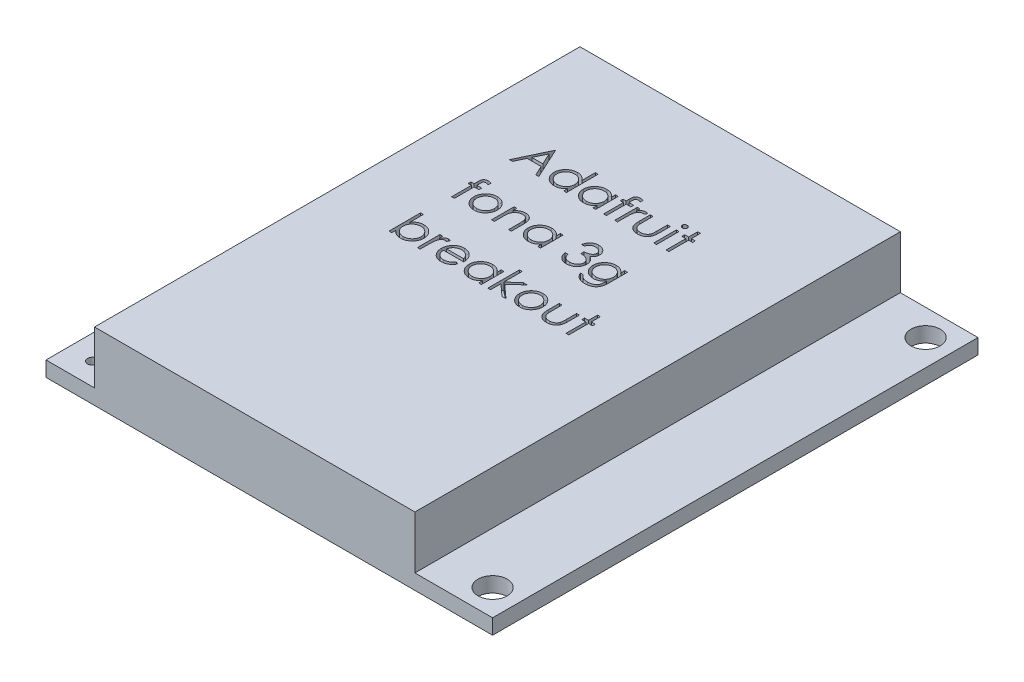
from build123d import *

# Parameters (mm, degrees)
SKETCH1_W             = 46
SKETCH1_H             = 50
BOSS_EXTRUDE1_DEPTH   = 7
F_3_0MM_DOWEL_HOLE1_D = 3
F_1_0MM_DOWEL_HOLE1_D = 1
LPATTERN1_COUNT       = 19
LPATTERN1_PITCH       = 2.54
SKETCH7_W             = 5
SKETCH7_H             = 50
SKETCH7_W_2           = 8
CUT_EXTRUDE1_DEPTH    = 5.44
SKETCH8_W             = 0.284935897
SKETCH8_H             = 2.320192308
CUT_EXTRUDE2_DEPTH    = 1


with BuildPart() as part:
    # Sketch1 → Boss-Extrude1 (new body)
    with BuildSketch(Plane(origin=(0, 0, 0), x_dir=(1, 0, 0), z_dir=(0, 1, 0))):
        Rectangle(SKETCH1_W, SKETCH1_H)
    extrude(amount=BOSS_EXTRUDE1_DEPTH)

    # Ø3.0mm Dowel Hole1 (through all)
    with Locations(Plane(origin=(0, 7, 0), x_dir=(1, 0, 0), z_dir=(0, 1, 0))):
        with Locations((20.3, 22.3), (20.3, -22.3)):
            Hole(F_3_0MM_DOWEL_HOLE1_D / 2)

    # Ø1.0mm Dowel Hole1 (through all)
    with Locations(Plane(origin=(0, 7, 0), x_dir=(1, 0, 0), z_dir=(0, 1, 0))):
        with Locations((-20.5, 23)):
            f_1_0mm_dowel_hole1 = Hole(F_1_0MM_DOWEL_HOLE1_D / 2)

    # LPattern1: Ø1.0mm Dowel Hole1 ×19
    with Locations(*[(0, 0, i * LPATTERN1_PITCH) for i in range(1, LPATTERN1_COUNT)]):
        add(f_1_0mm_dowel_hole1, mode=Mode.SUBTRACT)

    # Sketch7 → Cut-Extrude1 (cut)
    with BuildSketch(Plane(origin=(0, 7, 0), x_dir=(1, 0, 0), z_dir=(0, 1, 0))):
        with Locations((-20.5, 0)):
            Rectangle(SKETCH7_W, SKETCH7_H)
        with Locations((19, 0)):
            Rectangle(SKETCH7_W_2, SKETCH7_H)
    extrude(amount=-CUT_EXTRUDE1_DEPTH, mode=Mode.SUBTRACT)

    # Sketch8 → Cut-Extrude2 (cut)
    # profile 1 of 23: a face of its own
    with BuildSketch(Plane(origin=(0, 7, 0), x_dir=(1, 0, 0), z_dir=(0, 1, 0))):
        Polygon((-10.0053869, 14.476928311), (-8.540002285, 11.301928311), (-8.84974287, 11.301928311), (-9.319123879, 12.319556516), (-10.758431772, 12.319556516), (-11.241169152, 11.301928311), (-11.552181772, 11.301928311), (-10.046092028, 14.476928311), align=None)
        Polygon((-10.028919552, 13.858083159), (-10.603879488, 12.645197542), (-9.469224039, 12.645197542), align=None, mode=Mode.SUBTRACT)
    # profile 2 of 23: a face of its own
    with BuildSketch(Plane(origin=(0, 7, 0), x_dir=(1, 0, 0), z_dir=(0, 1, 0))):
        with BuildLine():
            Line((-5.69064331, 14.558338568), (-5.69064331, 11.301928311))
            Line((-5.69064331, 11.301928311), (-5.975579208, 11.301928311))
            Line((-5.975579208, 11.301928311), (-5.975579208, 11.703255435))
            add(Edge.make_bspline(
                [(-5.975579208, 11.703255435), (-6.007709111, 11.666933803), (-6.07041102, 11.596051682), (-6.175132606, 11.503448568), (-6.286138024, 11.426905377), (-6.402888509, 11.365083668), (-6.525278629, 11.318645159), (-6.65303708, 11.285637715), (-6.786215975, 11.264416164), (-6.877159183, 11.262297059), (-6.923245474, 11.261223183)],
                knots=[0, 0, 0, 0, 1.074387032, 2.096679803, 3.090159297, 4.057316773, 5.018401886, 5.985159533, 6.978961417, 8, 8, 8, 8], degree=3))
            add(Edge.make_bspline(
                [(-6.923245474, 11.261223183), (-6.96421926, 11.262335678), (-7.045021382, 11.264529567), (-7.163883473, 11.281549657), (-7.278267157, 11.308882435), (-7.388280519, 11.346892527), (-7.49321168, 11.397312273), (-7.593959053, 11.457674691), (-7.690000709, 11.529557444), (-7.779872748, 11.611733727), (-7.862633206, 11.700992036), (-7.935260217, 11.79619264), (-7.995814797, 11.896923872), (-8.046451585, 12.001910376), (-8.085455411, 12.111960339), (-8.11264578, 12.226693199), (-8.129646042, 12.345973298), (-8.131839024, 12.427198437), (-8.132951003, 12.468384641)],
                knots=[0, 0, 0, 0, 1.033919861, 2.038935746, 3.024066025, 3.998881131, 4.97069526, 5.957263378, 6.95902576, 7.993208707, 9.027059324, 10.027763471, 11.009749337, 11.988697705, 12.965288445, 13.950418724, 14.960734635, 16, 16, 16, 16], degree=3))
            add(Edge.make_bspline(
                [(-8.132951003, 12.468384641), (-8.131814379, 12.508719572), (-8.129567334, 12.588459555), (-8.112827628, 12.705733803), (-8.08467807, 12.818689654), (-8.045173951, 12.926963452), (-7.99451732, 13.030686212), (-7.932896841, 13.129931292), (-7.860308064, 13.224972102), (-7.776621952, 13.313573858), (-7.685966839, 13.395416844), (-7.588985347, 13.466545049), (-7.488089942, 13.527973905), (-7.38171564, 13.576645273), (-7.271436909, 13.616023532), (-7.156271997, 13.643267724), (-7.036700065, 13.659321723), (-6.955519405, 13.661646516), (-6.914341227, 13.662825747)],
                knots=[0, 0, 0, 0, 1.020392517, 2.01726096, 2.990465484, 3.961182959, 4.928053699, 5.906110375, 6.912531644, 7.948652711, 8.985773172, 9.998621852, 10.987621588, 11.969261332, 12.953316658, 13.946091881, 14.958173133, 16, 16, 16, 16], degree=3))
            add(Edge.make_bspline(
                [(-6.914341227, 13.662825747), (-6.866973123, 13.661404167), (-6.773994798, 13.658613764), (-6.638015425, 13.635294416), (-6.509393807, 13.59613952), (-6.387389454, 13.542535286), (-6.272729718, 13.472866033), (-6.164574122, 13.38872722), (-6.064803536, 13.287737595), (-6.005774097, 13.211889953), (-5.975579208, 13.173092173)],
                knots=[0, 0, 0, 0, 1.031072012, 2.023879775, 2.993683497, 3.952812103, 4.918022106, 5.908088563, 6.929940113, 8, 8, 8, 8], degree=3))
            Line((-5.975579208, 13.173092173), (-5.975579208, 14.558338568))
            Line((-5.975579208, 14.558338568), (-5.69064331, 14.558338568))
        make_face()
        with BuildLine():
            add(Edge.make_bspline(
                [(-6.910525121, 13.37788985), (-6.952175985, 13.376407907), (-7.034388165, 13.373482788), (-7.155078081, 13.350646831), (-7.270569535, 13.312651521), (-7.380284903, 13.260688653), (-7.482491071, 13.195348299), (-7.573834615, 13.116316759), (-7.655062637, 13.025750324), (-7.723377991, 12.924057696), (-7.779067941, 12.815038999), (-7.818226606, 12.701079687), (-7.844052281, 12.584235172), (-7.846690724, 12.504984735), (-7.848015105, 12.465204553)],
                knots=[0, 0, 0, 0, 1.031046209, 2.035121221, 3.029706178, 4.034933723, 5.034054252, 6.02443088, 7.017295772, 8.038157696, 9.050218397, 10.03989886, 11.016116709, 12, 12, 12, 12], degree=3))
            add(Edge.make_bspline(
                [(-7.848015105, 12.465204553), (-7.846323381, 12.425662099), (-7.842946562, 12.346732183), (-7.818679861, 12.229728374), (-7.777967404, 12.115742208), (-7.722412105, 12.005741163), (-7.652846381, 11.903611301), (-7.572211674, 11.811318475), (-7.479728205, 11.73195292), (-7.377286824, 11.665515979), (-7.267878165, 11.61184712), (-7.15282167, 11.574504005), (-7.034280198, 11.550394161), (-6.953678438, 11.547577957), (-6.913069192, 11.54615908)],
                knots=[0, 0, 0, 0, 0.979072187, 1.954306742, 2.945804271, 3.96968567, 4.997920485, 5.998718438, 6.996577872, 8.005894225, 9.015743152, 10.005417472, 10.995077863, 12, 12, 12, 12], degree=3))
            add(Edge.make_bspline(
                [(-6.913069192, 11.54615908), (-6.871842721, 11.547664905), (-6.789847361, 11.55065984), (-6.66879939, 11.57359356), (-6.551328959, 11.611483827), (-6.439036259, 11.664006606), (-6.334428055, 11.729100779), (-6.240540694, 11.805307211), (-6.161151209, 11.893937957), (-6.093847913, 11.991343739), (-6.041074499, 12.098125336), (-6.00263336, 12.211821352), (-5.979905888, 12.332435745), (-5.977041376, 12.414862307), (-5.975579208, 12.456936324)],
                knots=[0, 0, 0, 0, 1.01762866, 2.023962475, 3.030623092, 4.058876274, 5.077231937, 6.066672613, 7.034107872, 8.005628644, 8.981990164, 9.965428785, 10.961468474, 12, 12, 12, 12], degree=3))
            add(Edge.make_bspline(
                [(-5.975579208, 12.456936324), (-5.976449753, 12.488992785), (-5.978163262, 12.552090043), (-5.99125385, 12.644734292), (-6.012077248, 12.733392743), (-6.041419845, 12.818158611), (-6.07996551, 12.898563232), (-6.126454555, 12.975183929), (-6.181704498, 13.047622199), (-6.244825944, 13.114880556), (-6.313918664, 13.176227419), (-6.387029425, 13.230986408), (-6.465024432, 13.275970509), (-6.546592029, 13.313200806), (-6.63187374, 13.34282732), (-6.721563516, 13.362591871), (-6.814708026, 13.376163019), (-6.878249805, 13.377308179), (-6.910525121, 13.37788985)],
                knots=[0, 0, 0, 0, 1.050140795, 2.067009409, 3.05949893, 4.030605086, 5.00011959, 5.97591094, 6.962425594, 7.979863591, 8.993523472, 9.986985069, 10.967611495, 11.937549037, 12.921786183, 13.919465291, 14.943216303, 16, 16, 16, 16], degree=3))
        make_face(mode=Mode.SUBTRACT)
    # profile 3 of 23: a face of its own
    with BuildSketch(Plane(origin=(0, 7, 0), x_dir=(1, 0, 0), z_dir=(0, 1, 0))):
        with BuildLine():
            Line((-2.678463823, 13.622120619), (-2.678463823, 11.301928311))
            Line((-2.678463823, 11.301928311), (-2.963399721, 11.301928311))
            Line((-2.963399721, 11.301928311), (-2.963399721, 11.703255435))
            add(Edge.make_bspline(
                [(-2.963399721, 11.703255435), (-2.995529623, 11.666933803), (-3.058231533, 11.596051682), (-3.162953119, 11.503448568), (-3.273958537, 11.426905377), (-3.390709021, 11.365083668), (-3.513099142, 11.318645159), (-3.640857593, 11.285637715), (-3.774036488, 11.264416164), (-3.864979696, 11.262297059), (-3.911065987, 11.261223183)],
                knots=[0, 0, 0, 0, 1.074387032, 2.096679803, 3.090159297, 4.057316773, 5.018401886, 5.985159533, 6.978961417, 8, 8, 8, 8], degree=3))
            add(Edge.make_bspline(
                [(-3.911065987, 11.261223183), (-3.952039773, 11.262335678), (-4.032841895, 11.264529567), (-4.151703986, 11.281549657), (-4.26608767, 11.308882435), (-4.376101032, 11.346892527), (-4.481032193, 11.397312273), (-4.581779566, 11.457674691), (-4.677821222, 11.529557444), (-4.767693261, 11.611733727), (-4.850453719, 11.700992036), (-4.92308073, 11.79619264), (-4.98363531, 11.896923872), (-5.034272097, 12.001910376), (-5.073275924, 12.111960339), (-5.100466292, 12.226693199), (-5.117466555, 12.345973298), (-5.119659537, 12.427198437), (-5.120771515, 12.468384641)],
                knots=[0, 0, 0, 0, 1.033919861, 2.038935746, 3.024066025, 3.998881131, 4.97069526, 5.957263378, 6.95902576, 7.993208707, 9.027059324, 10.027763471, 11.009749337, 11.988697705, 12.965288445, 13.950418724, 14.960734635, 16, 16, 16, 16], degree=3))
            add(Edge.make_bspline(
                [(-5.120771515, 12.468384641), (-5.119634891, 12.508719572), (-5.117387847, 12.588459555), (-5.10064814, 12.705733803), (-5.072498583, 12.818689654), (-5.032994464, 12.926963452), (-4.982337833, 13.030686212), (-4.920717354, 13.129931292), (-4.848128577, 13.224972102), (-4.764442465, 13.313573858), (-4.673787352, 13.395416844), (-4.57680586, 13.466545049), (-4.475910455, 13.527973905), (-4.369536152, 13.576645273), (-4.259257422, 13.616023532), (-4.14409251, 13.643267724), (-4.024520578, 13.659321723), (-3.943339917, 13.661646516), (-3.90216174, 13.662825747)],
                knots=[0, 0, 0, 0, 1.020392517, 2.01726096, 2.990465484, 3.961182959, 4.928053699, 5.906110375, 6.912531644, 7.948652711, 8.985773172, 9.998621852, 10.987621588, 11.969261332, 12.953316658, 13.946091881, 14.958173133, 16, 16, 16, 16], degree=3))
            add(Edge.make_bspline(
                [(-3.90216174, 13.662825747), (-3.854809011, 13.661521501), (-3.761952543, 13.658963936), (-3.626127849, 13.637679891), (-3.497636073, 13.601722138), (-3.375485339, 13.552811265), (-3.260114288, 13.487815632), (-3.152615152, 13.405828096), (-3.051862893, 13.307365734), (-2.993460771, 13.231736831), (-2.963399721, 13.19280872)],
                knots=[0, 0, 0, 0, 1.038897134, 2.037228247, 3.008116434, 3.962042015, 4.918381754, 5.904844433, 6.921570401, 8, 8, 8, 8], degree=3))
            Line((-2.963399721, 13.19280872), (-2.963399721, 13.622120619))
            Line((-2.963399721, 13.622120619), (-2.678463823, 13.622120619))
        make_face()
        with BuildLine():
            add(Edge.make_bspline(
                [(-3.898345634, 13.37788985), (-3.939996498, 13.376407907), (-4.022208678, 13.373482788), (-4.142898594, 13.350646831), (-4.258390048, 13.312651521), (-4.368105415, 13.260688653), (-4.470311583, 13.195348299), (-4.561655128, 13.116316759), (-4.64288315, 13.025750324), (-4.711198503, 12.924057696), (-4.766888454, 12.815038999), (-4.806047119, 12.701079687), (-4.831872793, 12.584235172), (-4.834511237, 12.504984735), (-4.835835618, 12.465204553)],
                knots=[0, 0, 0, 0, 1.031046209, 2.035121221, 3.029706178, 4.034933723, 5.034054252, 6.02443088, 7.017295772, 8.038157696, 9.050218397, 10.03989886, 11.016116709, 12, 12, 12, 12], degree=3))
            add(Edge.make_bspline(
                [(-4.835835618, 12.465204553), (-4.834143893, 12.425662099), (-4.830767075, 12.346732183), (-4.806500374, 12.229728374), (-4.765787917, 12.115742208), (-4.710232617, 12.005741163), (-4.640666893, 11.903611301), (-4.560032187, 11.811318475), (-4.467548718, 11.73195292), (-4.365107336, 11.665515979), (-4.255698677, 11.61184712), (-4.140642182, 11.574504005), (-4.022100711, 11.550394161), (-3.941498951, 11.547577957), (-3.900889705, 11.54615908)],
                knots=[0, 0, 0, 0, 0.979072187, 1.954306742, 2.945804271, 3.96968567, 4.997920485, 5.998718438, 6.996577872, 8.005894225, 9.015743152, 10.005417472, 10.995077863, 12, 12, 12, 12], degree=3))
            add(Edge.make_bspline(
                [(-3.900889705, 11.54615908), (-3.859663234, 11.547664905), (-3.777667874, 11.55065984), (-3.656619903, 11.57359356), (-3.539149472, 11.611483827), (-3.426856772, 11.664006606), (-3.322248568, 11.729100779), (-3.228361207, 11.805307211), (-3.148971722, 11.893937957), (-3.081668426, 11.991343739), (-3.028895012, 12.098125336), (-2.990453873, 12.211821352), (-2.967726401, 12.332435745), (-2.964861889, 12.414862307), (-2.963399721, 12.456936324)],
                knots=[0, 0, 0, 0, 1.01762866, 2.023962475, 3.030623092, 4.058876274, 5.077231937, 6.066672613, 7.034107872, 8.005628644, 8.981990164, 9.965428785, 10.961468474, 12, 12, 12, 12], degree=3))
            add(Edge.make_bspline(
                [(-2.963399721, 12.456936324), (-2.964270266, 12.488992785), (-2.965983775, 12.552090043), (-2.979074363, 12.644734292), (-2.99989776, 12.733392743), (-3.029240358, 12.818158611), (-3.067786023, 12.898563232), (-3.114275067, 12.975183929), (-3.169525011, 13.047622199), (-3.232646457, 13.114880556), (-3.301739176, 13.176227419), (-3.374849938, 13.230986408), (-3.452844944, 13.275970509), (-3.534412542, 13.313200806), (-3.619694253, 13.34282732), (-3.709384029, 13.362591871), (-3.802528539, 13.376163019), (-3.866070318, 13.377308179), (-3.898345634, 13.37788985)],
                knots=[0, 0, 0, 0, 1.050140795, 2.067009409, 3.05949893, 4.030605086, 5.00011959, 5.97591094, 6.962425594, 7.979863591, 8.993523472, 9.986985069, 10.967611495, 11.937549037, 12.921786183, 13.919465291, 14.943216303, 16, 16, 16, 16], degree=3))
        make_face(mode=Mode.SUBTRACT)
    # profile 4 of 23: a face of its own
    with BuildSketch(Plane(origin=(0, 7, 0), x_dir=(1, 0, 0), z_dir=(0, 1, 0))):
        with BuildLine():
            Line((-1.050258695, 14.539258039), (-1.050258695, 14.242873824))
            add(Edge.make_bspline(
                [(-1.050258695, 14.242873824), (-1.077236016, 14.253714973), (-1.128439532, 14.274291697), (-1.203950445, 14.296666036), (-1.27337303, 14.311122029), (-1.31796263, 14.31315035), (-1.339010698, 14.314107798)],
                knots=[0, 0, 0, 0, 1.16548392, 2.212112691, 3.15604595, 4, 4, 4, 4], degree=3))
            add(Edge.make_bspline(
                [(-1.339010698, 14.314107798), (-1.353229041, 14.31351694), (-1.380751011, 14.312373235), (-1.420305457, 14.30654187), (-1.455946383, 14.294655758), (-1.487610768, 14.279207771), (-1.513872971, 14.259836476), (-1.536357617, 14.240373487), (-1.552655826, 14.218434073), (-1.561504957, 14.198004844), (-1.566902458, 14.179090014), (-1.56852636, 14.159718644), (-1.572504103, 14.135929651), (-1.573613364, 14.106752564), (-1.576141905, 14.073095106), (-1.575918166, 14.034244992), (-1.577990011, 13.990813584), (-1.577679846, 13.960060943), (-1.577517309, 13.943945539)],
                knots=[0, 0, 0, 0, 1.311993654, 2.539582093, 3.670788641, 4.763509788, 5.772417512, 6.671800701, 7.496729179, 8.266799162, 8.712543678, 9.304149002, 10.05334463, 10.934920737, 11.99209668, 13.165090968, 14.514413552, 16, 16, 16, 16], degree=3))
            Line((-1.577517309, 13.943945539), (-1.577517309, 13.622120619))
            Line((-1.577517309, 13.622120619), (-1.090963823, 13.622120619))
            Line((-1.090963823, 13.622120619), (-1.090963823, 13.337184721))
            Line((-1.090963823, 13.337184721), (-1.578153326, 13.337184721))
            Line((-1.578153326, 13.337184721), (-1.579425362, 11.301928311))
            Line((-1.579425362, 11.301928311), (-1.864361259, 11.301928311))
            Line((-1.864361259, 11.301928311), (-1.864361259, 13.337184721))
            Line((-1.864361259, 13.337184721), (-2.190002285, 13.337184721))
            Line((-2.190002285, 13.337184721), (-2.190002285, 13.622120619))
            Line((-2.190002285, 13.622120619), (-1.864361259, 13.622120619))
            Line((-1.864361259, 13.622120619), (-1.864361259, 13.992918896))
            add(Edge.make_bspline(
                [(-1.864361259, 13.992918896), (-1.864338386, 14.013488886), (-1.864294506, 14.052950421), (-1.861221241, 14.109746128), (-1.858594409, 14.16220027), (-1.853362347, 14.209905673), (-1.847319228, 14.25330896), (-1.838668569, 14.291765359), (-1.830493968, 14.326310955), (-1.81566346, 14.365411222), (-1.793509018, 14.409725173), (-1.757649483, 14.456555425), (-1.714657254, 14.498560627), (-1.663305418, 14.533945869), (-1.605506325, 14.563351338), (-1.541206971, 14.584435019), (-1.471107327, 14.596355279), (-1.422586551, 14.598128026), (-1.39752432, 14.599043696)],
                knots=[0, 0, 0, 0, 1.116398763, 2.141702935, 3.087165306, 3.966655413, 4.746276475, 5.464069668, 6.106083417, 6.67047701, 7.730773247, 8.782666744, 9.856985883, 10.980834087, 12.154321827, 13.366232824, 14.639591414, 16, 16, 16, 16], degree=3))
            add(Edge.make_bspline(
                [(-1.39752432, 14.599043696), (-1.372054689, 14.598175215), (-1.318582551, 14.596351885), (-1.234947061, 14.585073008), (-1.144598792, 14.565595717), (-1.08260835, 14.54828935), (-1.050258695, 14.539258039)],
                knots=[0, 0, 0, 0, 0.864728408, 1.815451418, 2.859995356, 4, 4, 4, 4], degree=3))
        make_face()
    # profile 5 of 23: a face of its own
    with BuildSketch(Plane(origin=(0, 7, 0), x_dir=(1, 0, 0), z_dir=(0, 1, 0))):
        with BuildLine():
            Line((-0.724617669, 13.622120619), (-0.439681772, 13.622120619))
            Line((-0.439681772, 13.622120619), (-0.439681772, 13.280579153))
            add(Edge.make_bspline(
                [(-0.439681772, 13.280579153), (-0.418646255, 13.312379797), (-0.378415992, 13.373198282), (-0.311547835, 13.453634005), (-0.243055527, 13.52023194), (-0.172611179, 13.573302989), (-0.09969676, 13.613047747), (-0.025912525, 13.642160715), (0.049902366, 13.659375851), (0.100849254, 13.661674241), (0.126373917, 13.662825747)],
                knots=[0, 0, 0, 0, 1.2804753, 2.448899062, 3.506932113, 4.484331642, 5.4025378, 6.288909075, 7.142734305, 8, 8, 8, 8], degree=3))
            add(Edge.make_bspline(
                [(0.126373917, 13.662825747), (0.146173513, 13.661745769), (0.186912469, 13.659523645), (0.24858239, 13.643910969), (0.312121807, 13.618984477), (0.353072401, 13.595543703), (0.374420792, 13.583323544)],
                knots=[0, 0, 0, 0, 0.901110191, 1.854092781, 2.881294221, 4, 4, 4, 4], degree=3))
            Line((0.374420792, 13.583323544), (0.217960456, 13.336548704))
            add(Edge.make_bspline(
                [(0.217960456, 13.336548704), (0.204254415, 13.342663088), (0.178237726, 13.35426936), (0.140178941, 13.368005326), (0.105089443, 13.376093336), (0.082734215, 13.377318629), (0.072312419, 13.37788985)],
                knots=[0, 0, 0, 0, 1.180555205, 2.24091978, 3.179933427, 4, 4, 4, 4], degree=3))
            add(Edge.make_bspline(
                [(0.072312419, 13.37788985), (0.049447218, 13.376365816), (0.002808835, 13.373257228), (-0.065666389, 13.348819881), (-0.132112068, 13.309336271), (-0.184882076, 13.265547476), (-0.225741834, 13.223321974), (-0.25489761, 13.186448066), (-0.281642674, 13.145101736), (-0.307197088, 13.099989809), (-0.330480083, 13.05034202), (-0.35221039, 12.996654391), (-0.371858073, 12.938864738), (-0.383061509, 12.898603452), (-0.388800362, 12.877979994)],
                knots=[0, 0, 0, 0, 1.125678352, 2.296057538, 3.5422874, 4.923748041, 5.663163013, 6.437101912, 7.23742474, 8.08941207, 8.991984279, 9.93940061, 10.944477711, 12, 12, 12, 12], degree=3))
            add(Edge.make_bspline(
                [(-0.388800362, 12.877979994), (-0.393093318, 12.859585701), (-0.402601892, 12.818843739), (-0.411847072, 12.750491863), (-0.420981564, 12.669734687), (-0.42741921, 12.576347421), (-0.433386434, 12.470563275), (-0.436752009, 12.352221096), (-0.439567001, 12.221199413), (-0.439642354, 12.12960125), (-0.439681772, 12.081685923)],
                knots=[0, 0, 0, 0, 0.566838948, 1.255505196, 2.06880316, 3.007127437, 4.065329342, 5.249902469, 6.561414163, 8, 8, 8, 8], degree=3))
            Line((-0.439681772, 12.081685923), (-0.439681772, 11.301928311))
            Line((-0.439681772, 11.301928311), (-0.724617669, 11.301928311))
            Line((-0.724617669, 11.301928311), (-0.724617669, 13.622120619))
        make_face()
    # profile 6 of 23: a face of its own
    with BuildSketch(Plane(origin=(0, 7, 0), x_dir=(1, 0, 0), z_dir=(0, 1, 0))):
        with BuildLine():
            Line((0.618651561, 13.622120619), (0.903587459, 13.622120619))
            Line((0.903587459, 13.622120619), (0.903587459, 12.545978792))
            add(Edge.make_bspline(
                [(0.903587459, 12.545978792), (0.903716187, 12.514389584), (0.903962438, 12.453960908), (0.905632434, 12.36700656), (0.909560448, 12.287707114), (0.91447156, 12.21601676), (0.920787212, 12.151947626), (0.928301403, 12.095723495), (0.936700114, 12.046706771), (0.94492129, 12.017185298), (0.948744711, 12.003455755)],
                knots=[0, 0, 0, 0, 1.388932606, 2.656963016, 3.823490214, 4.879454478, 5.816252168, 6.653371382, 7.373723809, 8, 8, 8, 8], degree=3))
            add(Edge.make_bspline(
                [(0.948744711, 12.003455755), (0.954878316, 11.986199294), (0.967018011, 11.952045128), (0.989037529, 11.902706531), (1.01627752, 11.857008953), (1.046086078, 11.813190258), (1.080466255, 11.772548456), (1.118983061, 11.735152178), (1.160347176, 11.699588467), (1.221810661, 11.657510834), (1.305865852, 11.612411927), (1.41622228, 11.573499292), (1.535878257, 11.550243941), (1.618577681, 11.547545867), (1.661084454, 11.54615908)],
                knots=[0, 0, 0, 0, 0.725840625, 1.436591201, 2.137033971, 2.831655856, 3.53531722, 4.242432219, 4.957935707, 5.694543706, 7.190802206, 8.724350549, 10.316345118, 12, 12, 12, 12], degree=3))
            add(Edge.make_bspline(
                [(1.661084454, 11.54615908), (1.703587279, 11.547575356), (1.785822381, 11.550315587), (1.904163674, 11.572797797), (2.012341743, 11.610358672), (2.109270821, 11.662798253), (2.194511261, 11.72697141), (2.265544555, 11.802272258), (2.324152565, 11.886318487), (2.349742539, 11.949024083), (2.362611898, 11.980559121)],
                knots=[0, 0, 0, 0, 1.157059328, 2.238695713, 3.266970494, 4.264342957, 5.228770407, 6.160125903, 7.074715775, 8, 8, 8, 8], degree=3))
            add(Edge.make_bspline(
                [(2.362611898, 11.980559121), (2.366416664, 11.993228549), (2.374828072, 12.02123756), (2.383865348, 12.068753474), (2.392006467, 12.125417794), (2.398958062, 12.191601312), (2.403915745, 12.267131072), (2.406588212, 12.35198347), (2.409607433, 12.445892132), (2.409653259, 12.511630742), (2.409677203, 12.545978792)],
                knots=[0, 0, 0, 0, 0.557542046, 1.232589297, 2.036731608, 2.971723315, 4.038036528, 5.22795436, 6.551621927, 8, 8, 8, 8], degree=3))
            Line((2.409677203, 12.545978792), (2.409677203, 13.622120619))
            Line((2.409677203, 13.622120619), (2.6946131, 13.622120619))
            Line((2.6946131, 13.622120619), (2.6946131, 12.492553311))
            add(Edge.make_bspline(
                [(2.6946131, 12.492553311), (2.69421242, 12.454174663), (2.693435045, 12.379714835), (2.688439098, 12.271507105), (2.679866949, 12.170667069), (2.666856085, 12.077141348), (2.651556509, 11.991001347), (2.631820461, 11.912136664), (2.608254488, 11.840790283), (2.5816702, 11.775710242), (2.55026322, 11.716703417), (2.516855851, 11.660700212), (2.478279808, 11.609090192), (2.43766681, 11.559304253), (2.392489594, 11.513818725), (2.343594721, 11.471589886), (2.291670391, 11.431972207), (2.235564332, 11.396510832), (2.176095618, 11.364564304), (2.113190834, 11.336246862), (2.0460795, 11.313838095), (1.975627486, 11.294506277), (1.901489622, 11.279343866), (1.82373738, 11.268651766), (1.742396949, 11.262097359), (1.686961939, 11.261519468), (1.658540384, 11.261223183)],
                knots=[0, 0, 0, 0, 1.493040784, 2.896703357, 4.213163133, 5.428574705, 6.569057535, 7.615249723, 8.588095153, 9.490268104, 10.346124644, 11.18633936, 12.024365274, 12.850166724, 13.684164916, 14.514361689, 15.362232829, 16.222528818, 17.093394965, 17.986930858, 18.902426812, 19.842810585, 20.827885679, 21.843828298, 22.894529745, 24, 24, 24, 24], degree=3))
            add(Edge.make_bspline(
                [(1.658540384, 11.261223183), (1.630331403, 11.261531346), (1.57489813, 11.262136915), (1.493553501, 11.268615555), (1.415585837, 11.279327252), (1.341272333, 11.294617342), (1.270538415, 11.313702784), (1.203097569, 11.336384563), (1.13973948, 11.364579), (1.079702947, 11.396308641), (1.023457924, 11.432199998), (0.970745142, 11.471541006), (0.921635283, 11.514272934), (0.876117514, 11.560217323), (0.834830743, 11.609944115), (0.797260476, 11.663053302), (0.762828322, 11.719018654), (0.731665434, 11.778947379), (0.704894056, 11.84478056), (0.681258225, 11.917621498), (0.661926432, 11.998268781), (0.646194336, 12.086653459), (0.633538386, 12.182352532), (0.624751671, 12.285919595), (0.619838739, 12.397102373), (0.619055819, 12.473891916), (0.618651561, 12.513541893)],
                knots=[0, 0, 0, 0, 1.083640291, 2.129454052, 3.13281866, 4.105697902, 5.042300162, 5.946461698, 6.836384745, 7.703652036, 8.553297018, 9.397182691, 10.228592656, 11.052265423, 11.879314572, 12.708807002, 13.549817954, 14.402308542, 15.300838682, 16.27712199, 17.341985831, 18.484375296, 19.725102775, 21.0496083, 22.476576903, 24, 24, 24, 24], degree=3))
            Line((0.618651561, 12.513541893), (0.618651561, 13.622120619))
        make_face()
    # profile 7 of 23: a face of its own
    with BuildSketch(Plane(origin=(0, 7, 0), x_dir=(1, 0, 0), z_dir=(0, 1, 0))):
        with BuildLine():
            add(Edge.make_bspline(
                [(3.446385936, 14.599043696), (3.464067344, 14.5982235), (3.498690937, 14.5966174), (3.548759115, 14.582863775), (3.594349405, 14.559550489), (3.634787777, 14.528272492), (3.669487703, 14.491488354), (3.693781633, 14.448615905), (3.709395735, 14.402298425), (3.711281282, 14.369990451), (3.712241305, 14.353540891)],
                knots=[0, 0, 0, 0, 1.055194115, 2.066272739, 3.074728998, 4.095836921, 5.109056067, 6.073838105, 7.019297344, 8, 8, 8, 8], degree=3))
            add(Edge.make_bspline(
                [(3.712241305, 14.353540891), (3.711259632, 14.337518342), (3.709318979, 14.305843657), (3.693793693, 14.26032915), (3.669280663, 14.218052408), (3.634810028, 14.181339692), (3.594343509, 14.150078987), (3.548760682, 14.126761116), (3.498690525, 14.113008706), (3.464067205, 14.111402438), (3.446385936, 14.110582157)],
                knots=[0, 0, 0, 0, 0.96129708, 1.900370562, 2.859976407, 3.87933698, 4.906634145, 5.921202961, 6.938410037, 8, 8, 8, 8], degree=3))
            add(Edge.make_bspline(
                [(3.446385936, 14.110582157), (3.428906858, 14.111371118), (3.394886116, 14.112906726), (3.345567624, 14.127030957), (3.300366065, 14.150086966), (3.259848827, 14.181135005), (3.226075723, 14.218277876), (3.20149367, 14.26030335), (3.186004241, 14.305850226), (3.184058756, 14.337520548), (3.183074638, 14.353540891)],
                knots=[0, 0, 0, 0, 1.054934014, 2.053291228, 3.073705704, 4.106921865, 5.123545215, 6.088680038, 7.033164197, 8, 8, 8, 8], degree=3))
            add(Edge.make_bspline(
                [(3.183074638, 14.353540891), (3.184037196, 14.369988162), (3.185927719, 14.40229164), (3.201505281, 14.448642134), (3.225870964, 14.491261067), (3.259871189, 14.528477056), (3.300360114, 14.559542558), (3.345569161, 14.582593948), (3.39488571, 14.596719377), (3.42890672, 14.59825482), (3.446385936, 14.599043696)],
                knots=[0, 0, 0, 0, 0.98631895, 1.937192651, 2.907499808, 3.917963147, 4.944918757, 5.95915025, 6.951458133, 8, 8, 8, 8], degree=3))
        make_face()
    # profile 8 of 23: a face of its own
    with BuildSketch(Plane(origin=(0, 7, 0), x_dir=(1, 0, 0), z_dir=(0, 1, 0))):
        with Locations((3.447657971, 12.462024465)):
            Rectangle(SKETCH8_W, SKETCH8_H)
    # profile 9 of 23: a face of its own
    with BuildSketch(Plane(origin=(0, 7, 0), x_dir=(1, 0, 0), z_dir=(0, 1, 0))):
        Polygon((4.567048997, 14.558338568), (4.851984895, 14.558338568), (4.851984895, 13.622120619), (5.259036177, 13.622120619), (5.259036177, 13.337184721), (4.851984895, 13.337184721), (4.851984895, 11.301928311), (4.567048997, 11.301928311), (4.567048997, 13.337184721), (4.159997715, 13.337184721), (4.159997715, 13.622120619), (4.567048997, 13.622120619), align=None)
    # profile 10 of 23: a face of its own
    with BuildSketch(Plane(origin=(0, 7, 0), x_dir=(1, 0, 0), z_dir=(0, 1, 0))):
        with BuildLine():
            Line((-10.412438182, 8.247591372), (-10.412438182, 7.951207157))
            add(Edge.make_bspline(
                [(-10.412438182, 7.951207157), (-10.439415503, 7.962048306), (-10.490619019, 7.982625031), (-10.566129932, 8.00499937), (-10.635552517, 8.019455362), (-10.680142117, 8.021483683), (-10.701190185, 8.022441132)],
                knots=[0, 0, 0, 0, 1.16548392, 2.212112691, 3.15604595, 4, 4, 4, 4], degree=3))
            add(Edge.make_bspline(
                [(-10.701190185, 8.022441132), (-10.715408528, 8.021850273), (-10.742930498, 8.020706568), (-10.782484944, 8.014875204), (-10.818125871, 8.002989091), (-10.849790255, 7.987541105), (-10.876052458, 7.968169809), (-10.898537104, 7.94870682), (-10.914835313, 7.926767406), (-10.923684444, 7.906338177), (-10.929081945, 7.887423347), (-10.930705847, 7.868051977), (-10.93468359, 7.844262985), (-10.935792851, 7.815085898), (-10.938321392, 7.781428439), (-10.938097654, 7.742578326), (-10.940169498, 7.699146918), (-10.939859333, 7.668394277), (-10.939696796, 7.652278872)],
                knots=[0, 0, 0, 0, 1.311993654, 2.539582093, 3.670788641, 4.763509788, 5.772417512, 6.671800701, 7.496729179, 8.266799162, 8.712543678, 9.304149002, 10.05334463, 10.934920737, 11.99209668, 13.165090968, 14.514413552, 16, 16, 16, 16], degree=3))
            Line((-10.939696796, 7.652278872), (-10.939696796, 7.330453952))
            Line((-10.939696796, 7.330453952), (-10.45314331, 7.330453952))
            Line((-10.45314331, 7.330453952), (-10.45314331, 7.045518055))
            Line((-10.45314331, 7.045518055), (-10.940332814, 7.045518055))
            Line((-10.940332814, 7.045518055), (-10.941604849, 5.010261645))
            Line((-10.941604849, 5.010261645), (-11.226540746, 5.010261645))
            Line((-11.226540746, 5.010261645), (-11.226540746, 7.045518055))
            Line((-11.226540746, 7.045518055), (-11.552181772, 7.045518055))
            Line((-11.552181772, 7.045518055), (-11.552181772, 7.330453952))
            Line((-11.552181772, 7.330453952), (-11.226540746, 7.330453952))
            Line((-11.226540746, 7.330453952), (-11.226540746, 7.70125223))
            add(Edge.make_bspline(
                [(-11.226540746, 7.70125223), (-11.226517873, 7.72182222), (-11.226473993, 7.761283755), (-11.223400729, 7.818079461), (-11.220773897, 7.870533604), (-11.215541834, 7.918239006), (-11.209498715, 7.961642293), (-11.200848056, 8.000098692), (-11.192673456, 8.034644288), (-11.177842947, 8.073744556), (-11.155688505, 8.118058506), (-11.11982897, 8.164888758), (-11.076836742, 8.20689396), (-11.025484905, 8.242279202), (-10.967685812, 8.271684671), (-10.903386458, 8.292768352), (-10.833286814, 8.304688613), (-10.784766038, 8.30646136), (-10.759703807, 8.307377029)],
                knots=[0, 0, 0, 0, 1.116398763, 2.141702935, 3.087165306, 3.966655413, 4.746276475, 5.464069668, 6.106083417, 6.67047701, 7.730773247, 8.782666744, 9.856985883, 10.980834087, 12.154321827, 13.366232824, 14.639591414, 16, 16, 16, 16], degree=3))
            add(Edge.make_bspline(
                [(-10.759703807, 8.307377029), (-10.734234176, 8.306508548), (-10.680762038, 8.304685218), (-10.597126549, 8.293406342), (-10.506778279, 8.27392905), (-10.444787837, 8.256622684), (-10.412438182, 8.247591372)],
                knots=[0, 0, 0, 0, 0.864728408, 1.815451418, 2.859995356, 4, 4, 4, 4], degree=3))
        make_face()
    # profile 11 of 23: a face of its own
    with BuildSketch(Plane(origin=(0, 7, 0), x_dir=(1, 0, 0), z_dir=(0, 1, 0))):
        with BuildLine():
            add(Edge.make_bspline(
                [(-8.884723839, 7.37115908), (-8.841188899, 7.370232079), (-8.75582752, 7.368414456), (-8.630816081, 7.348988023), (-8.51148585, 7.319281486), (-8.397379805, 7.278213711), (-8.289959308, 7.223166513), (-8.187659679, 7.157480942), (-8.090761393, 7.079663875), (-8.032683359, 7.019467627), (-8.003203406, 6.988912486)],
                knots=[0, 0, 0, 0, 1.054011418, 2.066658804, 3.057071809, 4.030435133, 4.997543892, 5.974964718, 6.972108034, 8, 8, 8, 8], degree=3))
            add(Edge.make_bspline(
                [(-8.003203406, 6.988912486), (-7.977819777, 6.959689799), (-7.92754376, 6.901809964), (-7.863077001, 6.807960944), (-7.8075403, 6.710769567), (-7.763033186, 6.608945206), (-7.727940343, 6.503376754), (-7.703025032, 6.393701359), (-7.688205099, 6.280161229), (-7.686206693, 6.203050605), (-7.685194592, 6.163997622)],
                knots=[0, 0, 0, 0, 1.025258237, 2.030674902, 3.01204498, 3.988269485, 4.97094183, 5.956517959, 6.965070386, 8, 8, 8, 8], degree=3))
            add(Edge.make_bspline(
                [(-7.685194592, 6.163997622), (-7.686084806, 6.124718284), (-7.687843908, 6.04710048), (-7.704484189, 5.932782913), (-7.73036596, 5.821934752), (-7.76740627, 5.71502008), (-7.814902555, 5.611712087), (-7.872860536, 5.512461995), (-7.941686931, 5.417073989), (-8.019704842, 5.326358036), (-8.105930473, 5.242750112), (-8.19947155, 5.169880896), (-8.298489852, 5.107449942), (-8.404302037, 5.057161193), (-8.515941829, 5.017510251), (-8.633650026, 4.98966095), (-8.757243769, 4.972822852), (-8.841632748, 4.97066061), (-8.884723839, 4.969556516)],
                knots=[0, 0, 0, 0, 0.998656419, 1.973391657, 2.932242238, 3.890759089, 4.846373663, 5.82037756, 6.809684879, 7.83454468, 8.860553229, 9.859544525, 10.845671541, 11.83227036, 12.833544569, 13.85385346, 14.904124723, 16, 16, 16, 16], degree=3))
            add(Edge.make_bspline(
                [(-8.884723839, 4.969556516), (-8.928026049, 4.970664316), (-9.012835615, 4.972833997), (-9.136865612, 4.989595532), (-9.254784767, 5.017497416), (-9.36657071, 5.057291499), (-9.472837821, 5.107451549), (-9.572429857, 5.169692153), (-9.666046924, 5.242771723), (-9.752290795, 5.32635218), (-9.830303816, 5.417075497), (-9.899131473, 5.512461604), (-9.957089126, 5.611712189), (-10.004585497, 5.715020053), (-10.041625784, 5.821934759), (-10.067507561, 5.932782911), (-10.08414784, 6.047100481), (-10.085906943, 6.124718284), (-10.086797156, 6.163997622)],
                knots=[0, 0, 0, 0, 1.099876186, 2.154163076, 3.173186993, 4.173200201, 5.163417411, 6.152872554, 7.150605724, 8.17532212, 9.198891216, 10.186952605, 11.159729845, 12.11414092, 13.071450619, 14.029093627, 15.002601286, 16, 16, 16, 16], degree=3))
            add(Edge.make_bspline(
                [(-10.086797156, 6.163997622), (-10.085778154, 6.202838346), (-10.083760703, 6.279736304), (-10.06895567, 6.393062995), (-10.04413755, 6.502552769), (-10.009002641, 6.607713736), (-9.964085289, 6.709091882), (-9.909328978, 6.806523407), (-9.844204618, 6.899948055), (-9.794128562, 6.957753085), (-9.768788342, 6.987004433)],
                knots=[0, 0, 0, 0, 1.031353054, 2.041901799, 3.029428768, 4.008703097, 4.981709435, 5.96992636, 6.972712378, 8, 8, 8, 8], degree=3))
            add(Edge.make_bspline(
                [(-9.768788342, 6.987004433), (-9.739352835, 7.017824557), (-9.68146273, 7.078437752), (-9.584082098, 7.156027971), (-9.482034132, 7.223080409), (-9.37342652, 7.277033833), (-9.259414213, 7.31952306), (-9.139472472, 7.349064634), (-9.014036826, 7.368344463), (-8.928257741, 7.370211525), (-8.884723839, 7.37115908)],
                knots=[0, 0, 0, 0, 1.027980169, 2.021703884, 2.998553061, 3.971491411, 4.943284454, 5.930300938, 6.949603206, 8, 8, 8, 8], degree=3))
        make_face()
        with BuildLine():
            add(Edge.make_bspline(
                [(-8.885995874, 7.086223183), (-8.916782136, 7.085348161), (-8.977559917, 7.083620704), (-9.067021969, 7.070481734), (-9.153146251, 7.049665069), (-9.23609616, 7.020088532), (-9.315591966, 6.981898817), (-9.391709782, 6.934991947), (-9.464673495, 6.879989194), (-9.533055795, 6.816976628), (-9.595814036, 6.74814354), (-9.6506762, 6.674802528), (-9.697326118, 6.5981432), (-9.736188262, 6.518085837), (-9.76513264, 6.433819147), (-9.786153882, 6.346297432), (-9.799280457, 6.255342375), (-9.800991672, 6.193510595), (-9.801861259, 6.162089569)],
                knots=[0, 0, 0, 0, 1.021534396, 2.016698045, 2.994645724, 3.958388632, 4.93408049, 5.916473867, 6.921342795, 7.962252576, 8.998418191, 10.008913653, 10.997312074, 11.973003931, 12.956656626, 13.948281152, 14.957379055, 16, 16, 16, 16], degree=3))
            add(Edge.make_bspline(
                [(-9.801861259, 6.162089569), (-9.80040364, 6.121493087), (-9.79751054, 6.040916662), (-9.773983576, 5.922252287), (-9.734626022, 5.808331607), (-9.681478989, 5.699822457), (-9.614889063, 5.59942689), (-9.536432938, 5.509917758), (-9.446952638, 5.432642057), (-9.347514813, 5.368524433), (-9.240150539, 5.317579512), (-9.126525162, 5.281476156), (-9.008015389, 5.258006835), (-8.927025012, 5.25567414), (-8.885995874, 5.254492414)],
                knots=[0, 0, 0, 0, 1.016792936, 2.018143844, 3.017858371, 4.030088057, 5.03801393, 6.028138512, 7.003788237, 7.991172063, 8.984598303, 9.972568034, 10.972917682, 12, 12, 12, 12], degree=3))
            add(Edge.make_bspline(
                [(-8.885995874, 5.254492414), (-8.844969097, 5.255681025), (-8.763983378, 5.258027311), (-8.645638267, 5.281357955), (-8.53232345, 5.317737704), (-8.425070691, 5.368467137), (-8.32567813, 5.432885542), (-8.235554284, 5.509481398), (-8.157768044, 5.599663964), (-8.091243988, 5.699955436), (-8.037226585, 5.808163384), (-7.998053252, 5.922273313), (-7.974469728, 6.040911308), (-7.971584262, 6.121491293), (-7.97013049, 6.162089569)],
                knots=[0, 0, 0, 0, 1.02726834, 2.027799167, 3.010890988, 4.004497153, 4.992059811, 5.971914811, 6.958719428, 7.966827853, 8.981595046, 9.981490638, 10.983022906, 12, 12, 12, 12], degree=3))
            add(Edge.make_bspline(
                [(-7.97013049, 6.162089569), (-7.970999778, 6.193510782), (-7.972710403, 6.255342933), (-7.985841264, 6.346295301), (-8.006846646, 6.433826964), (-8.03584947, 6.518056996), (-8.074542754, 6.598350482), (-8.122092274, 6.674577448), (-8.176730418, 6.748397601), (-8.240245949, 6.816754118), (-8.308556871, 6.880013758), (-8.381550155, 6.935013276), (-8.4575551, 6.981692666), (-8.536819957, 7.020415184), (-8.619780501, 7.049395986), (-8.705784111, 7.07060193), (-8.79486446, 7.08356518), (-8.855424449, 7.085331515), (-8.885995874, 7.086223183)],
                knots=[0, 0, 0, 0, 1.042956736, 2.052379634, 3.044323526, 4.02829302, 5.004299113, 5.996692471, 7.007513377, 8.048758398, 9.090003419, 10.095195979, 11.07790575, 12.047570684, 13.018257071, 13.989683339, 14.985167495, 16, 16, 16, 16], degree=3))
        make_face(mode=Mode.SUBTRACT)
    # profile 12 of 23: a face of its own
    with BuildSketch(Plane(origin=(0, 7, 0), x_dir=(1, 0, 0), z_dir=(0, 1, 0))):
        with BuildLine():
            Line((-7.115322797, 7.330453952), (-6.8303869, 7.330453952))
            Line((-6.8303869, 7.330453952), (-6.8303869, 6.911954353))
            add(Edge.make_bspline(
                [(-6.8303869, 6.911954353), (-6.799963474, 6.94991168), (-6.740925754, 7.023569198), (-6.64260568, 7.120380005), (-6.538697999, 7.200158887), (-6.429839039, 7.263753043), (-6.315881023, 7.311692483), (-6.197518592, 7.346314434), (-6.074043109, 7.367074243), (-5.990073941, 7.369786809), (-5.947594432, 7.37115908)],
                knots=[0, 0, 0, 0, 1.12780773, 2.188550248, 3.19190651, 4.159438251, 5.104880172, 6.052711206, 7.014878035, 8, 8, 8, 8], degree=3))
            add(Edge.make_bspline(
                [(-5.947594432, 7.37115908), (-5.904658785, 7.369575939), (-5.820623368, 7.366477349), (-5.698269698, 7.341969351), (-5.583993834, 7.300109012), (-5.478203237, 7.242766634), (-5.382837836, 7.171459333), (-5.299086007, 7.088385202), (-5.229813632, 6.992830327), (-5.18337031, 6.904181464), (-5.15277633, 6.825542343), (-5.133515566, 6.758189934), (-5.11715889, 6.683152754), (-5.102978662, 6.600657556), (-5.09338371, 6.51012634), (-5.08581606, 6.411930219), (-5.08039253, 6.306101001), (-5.08017735, 6.232906703), (-5.080066387, 6.195162486)],
                knots=[0, 0, 0, 0, 1.235846778, 2.418850247, 3.575807741, 4.728682307, 5.871620074, 6.994088408, 8.11269785, 9.256955736, 9.865816715, 10.540099792, 11.271859618, 12.076849838, 12.949306005, 13.892391288, 14.913166135, 16, 16, 16, 16], degree=3))
            Line((-5.080066387, 6.195162486), (-5.080066387, 5.010261645))
            Line((-5.080066387, 5.010261645), (-5.365002285, 5.010261645))
            Line((-5.365002285, 5.010261645), (-5.365002285, 6.101667895))
            add(Edge.make_bspline(
                [(-5.365002285, 6.101667895), (-5.365177552, 6.133256827), (-5.365512808, 6.193681078), (-5.366570216, 6.280194406), (-5.369119112, 6.358650088), (-5.372700796, 6.428860557), (-5.377943203, 6.490758394), (-5.38340659, 6.544469667), (-5.390087676, 6.58992618), (-5.396041175, 6.617290219), (-5.398711219, 6.629562526)],
                knots=[0, 0, 0, 0, 1.430800155, 2.736877192, 3.918605307, 4.986035426, 5.920637409, 6.731861385, 7.431261377, 8, 8, 8, 8], degree=3))
            add(Edge.make_bspline(
                [(-5.398711219, 6.629562526), (-5.408350094, 6.665586244), (-5.426901946, 6.734920755), (-5.472743488, 6.828968203), (-5.530632066, 6.90897656), (-5.601296544, 6.974451157), (-5.684054348, 7.02540613), (-5.778675828, 7.060761075), (-5.88424788, 7.082873833), (-5.958501499, 7.085075589), (-5.997203807, 7.086223183)],
                knots=[0, 0, 0, 0, 1.084156227, 2.086665306, 3.027808233, 3.945421172, 4.874247719, 5.839848303, 6.874090471, 8, 8, 8, 8], degree=3))
            add(Edge.make_bspline(
                [(-5.997203807, 7.086223183), (-6.020125206, 7.085791379), (-6.065486062, 7.084936849), (-6.132750679, 7.076363172), (-6.197996179, 7.062340144), (-6.261877369, 7.043409309), (-6.323116581, 7.017408536), (-6.383681331, 6.98789975), (-6.441291039, 6.951116729), (-6.49717412, 6.91012238), (-6.549165024, 6.864693385), (-6.597541446, 6.816755865), (-6.640665221, 6.765705853), (-6.679734662, 6.7123659), (-6.713460658, 6.656003447), (-6.742900246, 6.597162255), (-6.767879054, 6.535764877), (-6.780291211, 6.493151786), (-6.786501684, 6.471830154)],
                knots=[0, 0, 0, 0, 1.023777757, 2.026029729, 3.023749952, 4.003683103, 4.997618607, 5.993177895, 7.010360494, 8.046726602, 9.087585522, 10.09234134, 11.086953743, 12.070360549, 13.043493632, 14.017870808, 15.008233677, 16, 16, 16, 16], degree=3))
            add(Edge.make_bspline(
                [(-6.786501684, 6.471830154), (-6.790075508, 6.45617722), (-6.797855536, 6.422101601), (-6.806258563, 6.366181306), (-6.813885435, 6.301492972), (-6.820268962, 6.228112084), (-6.82417459, 6.145781726), (-6.828433078, 6.054853502), (-6.829983441, 5.954964837), (-6.830248648, 5.88542173), (-6.8303869, 5.849168896)],
                knots=[0, 0, 0, 0, 0.615963638, 1.340920617, 2.168419149, 3.115676021, 4.16674242, 5.331190069, 6.6087489, 8, 8, 8, 8], degree=3))
            Line((-6.8303869, 5.849168896), (-6.8303869, 5.010261645))
            Line((-6.8303869, 5.010261645), (-7.115322797, 5.010261645))
            Line((-7.115322797, 5.010261645), (-7.115322797, 7.330453952))
        make_face()
    # profile 13 of 23: a face of its own
    with BuildSketch(Plane(origin=(0, 7, 0), x_dir=(1, 0, 0), z_dir=(0, 1, 0))):
        with BuildLine():
            Line((-2.0678869, 7.330453952), (-2.0678869, 5.010261645))
            Line((-2.0678869, 5.010261645), (-2.352822797, 5.010261645))
            Line((-2.352822797, 5.010261645), (-2.352822797, 5.411588768))
            add(Edge.make_bspline(
                [(-2.352822797, 5.411588768), (-2.3849527, 5.375267136), (-2.44765461, 5.304385015), (-2.552376196, 5.211781902), (-2.663381614, 5.13523871), (-2.780132098, 5.073417001), (-2.902522219, 5.026978493), (-3.03028067, 4.993971048), (-3.163459565, 4.972749498), (-3.254402773, 4.970630392), (-3.300489064, 4.969556516)],
                knots=[0, 0, 0, 0, 1.074387032, 2.096679803, 3.090159297, 4.057316773, 5.018401886, 5.985159533, 6.978961417, 8, 8, 8, 8], degree=3))
            add(Edge.make_bspline(
                [(-3.300489064, 4.969556516), (-3.34146285, 4.970669011), (-3.422264972, 4.9728629), (-3.541127063, 4.98988299), (-3.655510747, 5.017215768), (-3.765524109, 5.055225861), (-3.870455269, 5.105645606), (-3.971202643, 5.166008024), (-4.067244299, 5.237890777), (-4.157116338, 5.32006706), (-4.239876796, 5.40932537), (-4.312503807, 5.504525973), (-4.373058387, 5.605257206), (-4.423695174, 5.71024371), (-4.462699001, 5.820293672), (-4.489889369, 5.935026532), (-4.506889632, 6.054306631), (-4.509082614, 6.13553177), (-4.510194592, 6.176717975)],
                knots=[0, 0, 0, 0, 1.033919861, 2.038935746, 3.024066025, 3.998881131, 4.97069526, 5.957263378, 6.95902576, 7.993208707, 9.027059324, 10.027763471, 11.009749337, 11.988697705, 12.965288445, 13.950418724, 14.960734635, 16, 16, 16, 16], degree=3))
            add(Edge.make_bspline(
                [(-4.510194592, 6.176717975), (-4.509057968, 6.217052906), (-4.506810924, 6.296792889), (-4.490071217, 6.414067136), (-4.461921659, 6.527022987), (-4.422417541, 6.635296785), (-4.37176091, 6.739019545), (-4.310140431, 6.838264625), (-4.237551654, 6.933305436), (-4.153865542, 7.021907191), (-4.063210429, 7.103750177), (-3.966228937, 7.174878383), (-3.865333532, 7.236307238), (-3.758959229, 7.284978606), (-3.648680499, 7.324356865), (-3.533515587, 7.351601058), (-3.413943655, 7.367655056), (-3.332762994, 7.36997985), (-3.291584817, 7.37115908)],
                knots=[0, 0, 0, 0, 1.020392517, 2.01726096, 2.990465484, 3.961182959, 4.928053699, 5.906110375, 6.912531644, 7.948652711, 8.985773172, 9.998621852, 10.987621588, 11.969261332, 12.953316658, 13.946091881, 14.958173133, 16, 16, 16, 16], degree=3))
            add(Edge.make_bspline(
                [(-3.291584817, 7.37115908), (-3.244232087, 7.369854834), (-3.15137562, 7.367297269), (-3.015550926, 7.346013224), (-2.88705915, 7.310055472), (-2.764908416, 7.261144598), (-2.649537365, 7.196148966), (-2.542038229, 7.11416143), (-2.441285969, 7.015699067), (-2.382883848, 6.940070164), (-2.352822797, 6.901142053)],
                knots=[0, 0, 0, 0, 1.038897134, 2.037228247, 3.008116434, 3.962042015, 4.918381754, 5.904844433, 6.921570401, 8, 8, 8, 8], degree=3))
            Line((-2.352822797, 6.901142053), (-2.352822797, 7.330453952))
            Line((-2.352822797, 7.330453952), (-2.0678869, 7.330453952))
        make_face()
        with BuildLine():
            add(Edge.make_bspline(
                [(-3.287768711, 7.086223183), (-3.329419575, 7.08474124), (-3.411631755, 7.081816121), (-3.532321671, 7.058980165), (-3.647813125, 7.020984854), (-3.757528492, 6.969021986), (-3.85973466, 6.903681632), (-3.951078204, 6.824650092), (-4.032306226, 6.734083658), (-4.10062158, 6.632391029), (-4.156311531, 6.523372332), (-4.195470196, 6.40941302), (-4.22129587, 6.292568505), (-4.223934314, 6.213318069), (-4.225258695, 6.173537887)],
                knots=[0, 0, 0, 0, 1.031046209, 2.035121221, 3.029706178, 4.034933723, 5.034054252, 6.02443088, 7.017295772, 8.038157696, 9.050218397, 10.03989886, 11.016116709, 12, 12, 12, 12], degree=3))
            add(Edge.make_bspline(
                [(-4.225258695, 6.173537887), (-4.22356697, 6.133995432), (-4.220190152, 6.055065517), (-4.195923451, 5.938061708), (-4.155210994, 5.824075541), (-4.099655694, 5.714074497), (-4.03008997, 5.611944634), (-3.949455264, 5.519651809), (-3.856971795, 5.440286254), (-3.754530413, 5.373849312), (-3.645121754, 5.320180454), (-3.530065259, 5.282837338), (-3.411523788, 5.258727494), (-3.330922028, 5.25591129), (-3.290312781, 5.254492414)],
                knots=[0, 0, 0, 0, 0.979072187, 1.954306742, 2.945804271, 3.96968567, 4.997920485, 5.998718438, 6.996577872, 8.005894225, 9.015743152, 10.005417472, 10.995077863, 12, 12, 12, 12], degree=3))
            add(Edge.make_bspline(
                [(-3.290312781, 5.254492414), (-3.249086311, 5.255998238), (-3.16709095, 5.258993174), (-3.04604298, 5.281926893), (-2.928572549, 5.31981716), (-2.816279849, 5.372339939), (-2.711671645, 5.437434112), (-2.617784284, 5.513640545), (-2.538394799, 5.60227129), (-2.471091503, 5.699677073), (-2.418318089, 5.806458669), (-2.37987695, 5.920154685), (-2.357149478, 6.040769078), (-2.354284966, 6.123195641), (-2.352822797, 6.165269657)],
                knots=[0, 0, 0, 0, 1.01762866, 2.023962475, 3.030623092, 4.058876274, 5.077231937, 6.066672613, 7.034107872, 8.005628644, 8.981990164, 9.965428785, 10.961468474, 12, 12, 12, 12], degree=3))
            add(Edge.make_bspline(
                [(-2.352822797, 6.165269657), (-2.353693343, 6.197326118), (-2.355406852, 6.260423377), (-2.36849744, 6.353067625), (-2.389320837, 6.441726076), (-2.418663434, 6.526491944), (-2.4572091, 6.606896565), (-2.503698144, 6.683517262), (-2.558948088, 6.755955532), (-2.622069534, 6.82321389), (-2.691162253, 6.884560752), (-2.764273015, 6.939319742), (-2.842268021, 6.984303843), (-2.923835619, 7.021534139), (-3.00911733, 7.051160653), (-3.098807106, 7.070925204), (-3.191951616, 7.084496353), (-3.255493395, 7.085641512), (-3.287768711, 7.086223183)],
                knots=[0, 0, 0, 0, 1.050140795, 2.067009409, 3.05949893, 4.030605086, 5.00011959, 5.97591094, 6.962425594, 7.979863591, 8.993523472, 9.986985069, 10.967611495, 11.937549037, 12.921786183, 13.919465291, 14.943216303, 16, 16, 16, 16], degree=3))
        make_face(mode=Mode.SUBTRACT)
    # profile 14 of 23: a face of its own
    with BuildSketch(Plane(origin=(0, 7, 0), x_dir=(1, 0, 0), z_dir=(0, 1, 0))):
        with BuildLine():
            Line((0.008074638, 7.452569337), (-0.276861259, 7.452569337))
            add(Edge.make_bspline(
                [(-0.276861259, 7.452569337), (-0.269141881, 7.484530233), (-0.254051128, 7.547011171), (-0.222575472, 7.636280615), (-0.188286148, 7.720756952), (-0.147111746, 7.79885839), (-0.102200233, 7.872154538), (-0.050744621, 7.938982958), (0.004881127, 8.001043291), (0.066408045, 8.05611887), (0.130931903, 8.105991525), (0.199361879, 8.148513898), (0.270321218, 8.185093666), (0.34430156, 8.215229162), (0.421523159, 8.237930887), (0.501287889, 8.254401703), (0.583804778, 8.265097928), (0.639818664, 8.266141835), (0.668260936, 8.266671901)],
                knots=[0, 0, 0, 0, 1.162005537, 2.271625781, 3.343758855, 4.383309926, 5.390229558, 6.379919256, 7.361854164, 8.333198761, 9.295911338, 10.242430842, 11.177959212, 12.116337295, 13.062827104, 14.020064771, 14.994644689, 16, 16, 16, 16], degree=3))
            add(Edge.make_bspline(
                [(0.668260936, 8.266671901), (0.70970171, 8.265420742), (0.791679312, 8.262945716), (0.912114362, 8.240344763), (1.028252977, 8.204580535), (1.138823937, 8.155165083), (1.24152923, 8.094216592), (1.332911342, 8.021677152), (1.411731634, 7.938946357), (1.477857248, 7.847567531), (1.529632426, 7.749908604), (1.567810779, 7.649397033), (1.591053304, 7.546271245), (1.594065523, 7.476641427), (1.595574638, 7.441757037)],
                knots=[0, 0, 0, 0, 1.083050992, 2.142477498, 3.193116406, 4.255571735, 5.30263384, 6.308962982, 7.297363603, 8.282367274, 9.249857812, 10.179914175, 11.08814088, 12, 12, 12, 12], degree=3))
            add(Edge.make_bspline(
                [(1.595574638, 7.441757037), (1.594519095, 7.408186588), (1.592453561, 7.342494428), (1.574915128, 7.246589927), (1.545400089, 7.156200761), (1.504515376, 7.070946421), (1.451591256, 6.991367459), (1.387481023, 6.917284829), (1.31173218, 6.84836995), (1.254329144, 6.808891571), (1.224776361, 6.788566933)],
                knots=[0, 0, 0, 0, 1.024540389, 2.004866551, 2.965041327, 3.920577974, 4.882998113, 5.874504559, 6.905732034, 8, 8, 8, 8], degree=3))
            add(Edge.make_bspline(
                [(1.224776361, 6.788566933), (1.258550881, 6.772258163), (1.325467974, 6.739945773), (1.416681669, 6.676576622), (1.499483742, 6.603409792), (1.545660687, 6.546311814), (1.568861898, 6.517623423)],
                knots=[0, 0, 0, 0, 1.015518401, 2.012035669, 3.001164323, 4, 4, 4, 4], degree=3))
            add(Edge.make_bspline(
                [(1.568861898, 6.517623423), (1.584139401, 6.496706749), (1.614444229, 6.455215924), (1.651850748, 6.388507881), (1.685786159, 6.321060459), (1.712229573, 6.251065854), (1.732707295, 6.179335335), (1.747344981, 6.105745733), (1.756438309, 6.030236955), (1.75774056, 5.979153491), (1.758395151, 5.953475787)],
                knots=[0, 0, 0, 0, 1.025084078, 2.033381695, 3.024893161, 4.013698104, 4.991890475, 5.976764909, 6.982997093, 8, 8, 8, 8], degree=3))
            add(Edge.make_bspline(
                [(1.758395151, 5.953475787), (1.756767271, 5.909016969), (1.753519172, 5.820308556), (1.724486904, 5.689249344), (1.679480607, 5.561137638), (1.615566101, 5.438605463), (1.537672004, 5.323960403), (1.445000717, 5.221384037), (1.338605189, 5.133211017), (1.219945779, 5.059541739), (1.091388098, 5.000651909), (0.953887383, 4.959778372), (0.809424834, 4.933157358), (0.710358214, 4.930302698), (0.659992707, 4.928851388)],
                knots=[0, 0, 0, 0, 0.955779014, 1.907060117, 2.875433937, 3.871313158, 4.872415639, 5.851225146, 6.836215519, 7.83643374, 8.849228613, 9.86973379, 10.916971861, 12, 12, 12, 12], degree=3))
            add(Edge.make_bspline(
                [(0.659992707, 4.928851388), (0.626048056, 4.929638982), (0.559256302, 4.931188703), (0.461063986, 4.941782863), (0.367336444, 4.961132224), (0.277946952, 4.987170223), (0.192816098, 5.020182732), (0.112203659, 5.061293265), (0.035613685, 5.109654413), (-0.036231078, 5.165837025), (-0.103322065, 5.228685098), (-0.163876322, 5.299314342), (-0.218903419, 5.37641913), (-0.266929956, 5.460895045), (-0.310143477, 5.551650386), (-0.345686202, 5.649847238), (-0.37696954, 5.754607744), (-0.391514182, 5.827612551), (-0.398976644, 5.865069337)],
                knots=[0, 0, 0, 0, 1.048658725, 2.063410685, 3.046034179, 4.001477787, 4.936774919, 5.862367409, 6.792675028, 7.730719943, 8.675894397, 9.627829632, 10.600096036, 11.597688215, 12.626045268, 13.701542398, 14.82072376, 16, 16, 16, 16], degree=3))
            Line((-0.398976644, 5.865069337), (-0.114040746, 5.865069337))
            add(Edge.make_bspline(
                [(-0.114040746, 5.865069337), (-0.106617332, 5.840622732), (-0.092178146, 5.793071962), (-0.067599747, 5.724636828), (-0.039597815, 5.661900594), (-0.009558179, 5.604403047), (0.02199084, 5.551577939), (0.057292236, 5.504822101), (0.093731389, 5.462081882), (0.121199088, 5.438002127), (0.134642146, 5.426217173)],
                knots=[0, 0, 0, 0, 1.198163088, 2.33053128, 3.407730985, 4.417276592, 5.372219308, 6.28897303, 7.162600585, 8, 8, 8, 8], degree=3))
            add(Edge.make_bspline(
                [(0.134642146, 5.426217173), (0.152419041, 5.412511756), (0.187917956, 5.385143227), (0.245764852, 5.35021675), (0.306602284, 5.319953534), (0.371748453, 5.296836182), (0.439797566, 5.277262161), (0.511849533, 5.264452833), (0.58726868, 5.255664277), (0.638765151, 5.254888732), (0.665080848, 5.254492414)],
                knots=[0, 0, 0, 0, 0.946170439, 1.889420265, 2.845303464, 3.807233317, 4.801018734, 5.828864929, 6.890507805, 8, 8, 8, 8], degree=3))
            add(Edge.make_bspline(
                [(0.665080848, 5.254492414), (0.694792954, 5.255051128), (0.752892413, 5.256143645), (0.837669321, 5.266190893), (0.918321077, 5.280823483), (0.993952231, 5.303423117), (1.065553477, 5.331345747), (1.132121116, 5.366405372), (1.194529012, 5.407539512), (1.25197783, 5.454292891), (1.303635541, 5.505475248), (1.349119242, 5.559008534), (1.387785899, 5.614667036), (1.418976716, 5.67275876), (1.443606144, 5.733043146), (1.460373048, 5.79568937), (1.472031208, 5.860184747), (1.472980634, 5.904026026), (1.473459254, 5.926127029)],
                knots=[0, 0, 0, 0, 1.217147791, 2.380027433, 3.494444702, 4.572153297, 5.609568379, 6.639424714, 7.649109417, 8.668170816, 9.669597737, 10.625200337, 11.543417969, 12.441394052, 13.322311151, 14.205496177, 15.095365482, 16, 16, 16, 16], degree=3))
            add(Edge.make_bspline(
                [(1.473459254, 5.926127029), (1.472071052, 5.955710172), (1.469301555, 6.014729257), (1.448157344, 6.101558771), (1.413378517, 6.185218581), (1.364689882, 6.264281333), (1.305421042, 6.337556615), (1.236147162, 6.402935746), (1.156292984, 6.456883614), (1.082796388, 6.494156895), (1.017695139, 6.519590528), (0.961982612, 6.536531388), (0.89961055, 6.550876633), (0.831333219, 6.564222765), (0.756636159, 6.575581417), (0.67560069, 6.585053635), (0.588210392, 6.592632851), (0.527711977, 6.596017487), (0.496536177, 6.597761645)],
                knots=[0, 0, 0, 0, 1.07054697, 2.135767047, 3.216561865, 4.33974944, 5.486079747, 6.621378074, 7.775625952, 8.963672916, 9.598146892, 10.304877434, 11.070270905, 11.915000392, 12.823868403, 13.805723172, 14.86925407, 16, 16, 16, 16], degree=3))
            Line((0.496536177, 6.597761645), (0.496536177, 6.92340267))
            add(Edge.make_bspline(
                [(0.496536177, 6.92340267), (0.53581652, 6.924069242), (0.612757063, 6.925374893), (0.725146897, 6.941166445), (0.832619115, 6.963011015), (0.932791946, 6.996471154), (1.024094707, 7.035333423), (1.10330606, 7.080556499), (1.169316258, 7.130825593), (1.221804516, 7.186916603), (1.261291745, 7.247073824), (1.290163197, 7.309772506), (1.307217778, 7.37556219), (1.309494405, 7.420460925), (1.310638741, 7.443029072)],
                knots=[0, 0, 0, 0, 1.321986639, 2.589447074, 3.816329219, 5.01088745, 6.139805852, 7.153945165, 8.075214402, 8.924034688, 9.728124013, 10.488707548, 11.240355623, 12, 12, 12, 12], degree=3))
            add(Edge.make_bspline(
                [(1.310638741, 7.443029072), (1.310262811, 7.459609598), (1.309514916, 7.492595768), (1.3000831, 7.540787795), (1.285909863, 7.58750651), (1.26642468, 7.632553238), (1.240344142, 7.675615558), (1.209132997, 7.717060601), (1.171969078, 7.756651743), (1.129382851, 7.793554605), (1.083652142, 7.828723841), (1.033532703, 7.858581212), (0.980535717, 7.884112804), (0.924602509, 7.905167138), (0.865551563, 7.921005207), (0.803660329, 7.932377006), (0.738810787, 7.939486878), (0.694567859, 7.940510513), (0.672077042, 7.941030875)],
                knots=[0, 0, 0, 0, 0.884392785, 1.759457502, 2.611959086, 3.489218968, 4.37281399, 5.2945488, 6.255912374, 7.266815255, 8.301784654, 9.332968512, 10.37626691, 11.440494194, 12.520033166, 13.637162961, 14.798855837, 16, 16, 16, 16], degree=3))
            add(Edge.make_bspline(
                [(0.672077042, 7.941030875), (0.635925886, 7.939768711), (0.565314271, 7.937303411), (0.46351931, 7.915710678), (0.368886772, 7.88125913), (0.29655241, 7.840135606), (0.243137503, 7.799540569), (0.204967709, 7.764087262), (0.167484103, 7.724687486), (0.133152668, 7.678914531), (0.098432703, 7.629868229), (0.066823708, 7.575055317), (0.03610813, 7.515905617), (0.017600103, 7.474090291), (0.008074638, 7.452569337)],
                knots=[0, 0, 0, 0, 1.472543308, 2.876219568, 4.221790263, 5.565193594, 6.249813518, 6.953379497, 7.687249741, 8.463570142, 9.283606569, 10.136032583, 11.040678096, 12, 12, 12, 12], degree=3))
        make_face()
    # profile 15 of 23: a face of its own
    with BuildSketch(Plane(origin=(0, 7, 0), x_dir=(1, 0, 0), z_dir=(0, 1, 0))):
        with BuildLine():
            Line((4.2821131, 7.330453952), (4.567048997, 7.330453952))
            Line((4.567048997, 7.330453952), (4.567048997, 5.489182919))
            add(Edge.make_bspline(
                [(4.567048997, 5.489182919), (4.56679768, 5.449960244), (4.566312577, 5.374251033), (4.562819196, 5.264778593), (4.555452582, 5.16366293), (4.547098993, 5.070442881), (4.535082328, 4.985550538), (4.520408052, 4.908732588), (4.503865686, 4.839915314), (4.489333061, 4.797529208), (4.482458653, 4.777479193)],
                knots=[0, 0, 0, 0, 1.307562039, 2.523909702, 3.650326591, 4.686913197, 5.643429486, 6.506965704, 7.293745905, 8, 8, 8, 8], degree=3))
            add(Edge.make_bspline(
                [(4.482458653, 4.777479193), (4.472308415, 4.751417049), (4.452311424, 4.700072004), (4.414859457, 4.627288013), (4.372918701, 4.558756646), (4.325015435, 4.494859815), (4.271366277, 4.435918287), (4.213235209, 4.380651516), (4.149490107, 4.330228736), (4.080167418, 4.28551993), (4.006865165, 4.245254531), (3.929625487, 4.210378002), (3.848883932, 4.180000651), (3.763882023, 4.157246972), (3.675952453, 4.137530476), (3.584061212, 4.124699225), (3.488745175, 4.115966108), (3.423934009, 4.11515854), (3.391052403, 4.114748824)],
                knots=[0, 0, 0, 0, 0.981931301, 1.934503488, 2.87077864, 3.801706999, 4.735015492, 5.667491629, 6.616593066, 7.585388521, 8.561939025, 9.551802639, 10.560317337, 11.588439944, 12.640189604, 13.723962949, 14.845264515, 16, 16, 16, 16], degree=3))
            add(Edge.make_bspline(
                [(3.391052403, 4.114748824), (3.343078394, 4.115525779), (3.249372264, 4.117043381), (3.112752021, 4.134724425), (2.982999096, 4.159720178), (2.861827982, 4.197552959), (2.750004394, 4.243850799), (2.648292021, 4.297004793), (2.557603945, 4.357955094), (2.475848899, 4.427352068), (2.402060457, 4.509869122), (2.332639272, 4.607113788), (2.265818275, 4.720567323), (2.226658153, 4.803836427), (2.206151561, 4.847441132)],
                knots=[0, 0, 0, 0, 1.157897085, 2.2616841, 3.32207898, 4.345638746, 5.321241055, 6.241986252, 7.112515963, 7.955008012, 8.825025602, 9.77857164, 10.836726669, 12, 12, 12, 12], degree=3))
            Line((2.206151561, 4.847441132), (2.491087459, 4.847441132))
            add(Edge.make_bspline(
                [(2.491087459, 4.847441132), (2.514003892, 4.811059373), (2.558802696, 4.739937515), (2.642575961, 4.64785058), (2.734384557, 4.569152885), (2.837326841, 4.505733826), (2.951831143, 4.457918515), (3.077966351, 4.423832353), (3.216758865, 4.403425026), (3.313386103, 4.400965495), (3.363703645, 4.399684721)],
                knots=[0, 0, 0, 0, 0.997731894, 1.950442991, 2.880492273, 3.800895997, 4.748200782, 5.754801363, 6.83083817, 8, 8, 8, 8], degree=3))
            add(Edge.make_bspline(
                [(3.363703645, 4.399684721), (3.413385038, 4.400982071), (3.509165792, 4.40348323), (3.646898352, 4.423841461), (3.77262376, 4.457925933), (3.885617657, 4.505649255), (3.984546818, 4.564114981), (4.069829124, 4.629429334), (4.138903224, 4.703072101), (4.1853607, 4.770909882), (4.214239246, 4.831347486), (4.232629061, 4.883374483), (4.247573305, 4.942205308), (4.260073586, 5.007642726), (4.270388629, 5.079780229), (4.276922672, 5.158782759), (4.281645087, 5.244470768), (4.281953488, 5.303882401), (4.2821131, 5.334630635)],
                knots=[0, 0, 0, 0, 1.570740765, 3.028230971, 4.391408896, 5.680370741, 6.894727393, 8.017376726, 9.065722033, 10.075533815, 10.603371122, 11.180248986, 11.817768598, 12.521299649, 13.286540596, 14.121245857, 15.027658897, 16, 16, 16, 16], degree=3))
            Line((4.2821131, 5.334630635), (4.2821131, 5.454837967))
            add(Edge.make_bspline(
                [(4.2821131, 5.454837967), (4.253192372, 5.420419332), (4.195859623, 5.352187475), (4.096847405, 5.262777991), (3.988700631, 5.185774144), (3.871603418, 5.122620097), (3.748424084, 5.07210909), (3.620496775, 5.036782262), (3.488968268, 5.013958638), (3.399839532, 5.011502715), (3.354799398, 5.010261645)],
                knots=[0, 0, 0, 0, 1.012485704, 2.007162095, 2.997754123, 3.998611389, 4.999708251, 5.992315798, 6.98544096, 8, 8, 8, 8], degree=3))
            add(Edge.make_bspline(
                [(3.354799398, 5.010261645), (3.328277925, 5.010728847), (3.275548834, 5.011657723), (3.197212741, 5.019784614), (3.12003263, 5.031576331), (3.044188498, 5.048885922), (2.969570907, 5.071103417), (2.896303162, 5.098877172), (2.823792035, 5.13027803), (2.753355569, 5.167264787), (2.685695293, 5.20841488), (2.621321546, 5.252990873), (2.560571514, 5.300759463), (2.504023413, 5.352191687), (2.451751419, 5.407213106), (2.403052481, 5.465237187), (2.358731888, 5.527074159), (2.31788017, 5.591596471), (2.282449392, 5.65923388), (2.251348569, 5.728519724), (2.224307181, 5.799305854), (2.202748566, 5.871829261), (2.186282913, 5.946044223), (2.174027207, 6.021829158), (2.167075834, 6.099417439), (2.165991867, 6.151688234), (2.165446433, 6.17799001)],
                knots=[0, 0, 0, 0, 1.028754217, 2.045334182, 3.052854819, 4.056607503, 5.061168794, 6.071104265, 7.095078842, 8.125279047, 9.155117945, 10.165957491, 11.161587969, 12.151493252, 13.128948131, 14.104219989, 15.088194871, 16.07871515, 17.064853787, 18.047899887, 19.02414258, 20.002704429, 20.980574569, 21.971845993, 22.979467364, 24, 24, 24, 24], degree=3))
            add(Edge.make_bspline(
                [(2.165446433, 6.17799001), (2.165917391, 6.204299961), (2.166857483, 6.256817962), (2.1749773, 6.334722833), (2.186559872, 6.411584535), (2.204891205, 6.48661082), (2.226955208, 6.560656131), (2.254281591, 6.633173545), (2.28713718, 6.70418515), (2.324338882, 6.773743532), (2.366143737, 6.840915297), (2.411983916, 6.904711611), (2.461914759, 6.964663024), (2.515247426, 7.02137435), (2.572633117, 7.074298419), (2.634042146, 7.12330678), (2.698869187, 7.169220932), (2.767315157, 7.211050502), (2.838323931, 7.248045826), (2.910091465, 7.281802967), (2.983568436, 7.308594633), (3.057384953, 7.332201301), (3.132841019, 7.348924657), (3.20901144, 7.361826262), (3.28615699, 7.369686402), (3.337821402, 7.370667554), (3.363703645, 7.37115908)],
                knots=[0, 0, 0, 0, 1.008818848, 2.013730394, 3.001654427, 3.987803273, 4.973046549, 5.963777569, 6.957074694, 7.972068341, 8.987420212, 9.989399531, 10.982630087, 11.977756091, 12.973280677, 13.973972381, 14.989194003, 16.018387222, 17.047741039, 18.059210846, 19.057554164, 20.045176975, 21.029480261, 22.018708529, 23.007435371, 24, 24, 24, 24], degree=3))
            add(Edge.make_bspline(
                [(3.363703645, 7.37115908), (3.406385568, 7.369928384), (3.490669252, 7.367498137), (3.614703804, 7.348428955), (3.734394264, 7.318026957), (3.850416036, 7.274469921), (3.963714233, 7.215006672), (4.073915449, 7.136681283), (4.181338521, 7.038791189), (4.247630553, 6.963722519), (4.2821131, 6.924674705)],
                knots=[0, 0, 0, 0, 0.96728863, 1.910097829, 2.838038873, 3.762875196, 4.71315279, 5.730631239, 6.819562287, 8, 8, 8, 8], degree=3))
            Line((4.2821131, 6.924674705), (4.2821131, 7.330453952))
        make_face()
        with BuildLine():
            add(Edge.make_bspline(
                [(3.386600279, 7.086223183), (3.344934569, 7.084807074), (3.262445299, 7.082003477), (3.141533731, 7.058068773), (3.02480537, 7.020562135), (2.914491874, 6.966911334), (2.811161853, 6.901511561), (2.719472552, 6.822281443), (2.639276664, 6.731797393), (2.571437855, 6.630877526), (2.517434401, 6.522000176), (2.479204299, 6.407236867), (2.454484635, 6.288441981), (2.451756265, 6.207368263), (2.450382331, 6.166541693)],
                knots=[0, 0, 0, 0, 1.026226791, 2.031711442, 3.026614839, 4.04107745, 5.047145931, 6.032893242, 7.017642609, 8.019221815, 9.021877557, 10.003543541, 10.994637589, 12, 12, 12, 12], degree=3))
            add(Edge.make_bspline(
                [(2.450382331, 6.166541693), (2.451040696, 6.135759367), (2.452335508, 6.075219534), (2.464784753, 5.986375872), (2.484906057, 5.901757302), (2.513424094, 5.821358705), (2.548759753, 5.744718927), (2.593202833, 5.672365907), (2.6455005, 5.604235209), (2.705243421, 5.540830748), (2.771080567, 5.483081155), (2.842490126, 5.432337361), (2.919375246, 5.390834921), (2.999844995, 5.354965733), (3.085851895, 5.328768293), (3.176157137, 5.308775972), (3.271399605, 5.297338027), (3.336325397, 5.295920346), (3.369427803, 5.295197542)],
                knots=[0, 0, 0, 0, 1.039728707, 2.044842319, 3.024901384, 3.974314358, 4.923051295, 5.871625912, 6.837440708, 7.820715446, 8.810779094, 9.792721783, 10.773906224, 11.758876063, 12.764959493, 13.806266761, 14.881525401, 16, 16, 16, 16], degree=3))
            add(Edge.make_bspline(
                [(3.369427803, 5.295197542), (3.402959213, 5.295893873), (3.468529528, 5.297255541), (3.564297449, 5.308960858), (3.655041435, 5.327849365), (3.740678281, 5.354667252), (3.821531326, 5.388886269), (3.896692298, 5.4321902), (3.96777279, 5.481506506), (4.032503247, 5.539030262), (4.091035883, 5.602425936), (4.142045222, 5.67140952), (4.185510472, 5.74494299), (4.221503787, 5.82301806), (4.248982236, 5.90624148), (4.267414386, 5.994405203), (4.280301933, 6.087086844), (4.2815002, 6.150594661), (4.2821131, 6.183078151)],
                knots=[0, 0, 0, 0, 1.121943988, 2.193949579, 3.223793937, 4.220241907, 5.192961521, 6.155822191, 7.11847367, 8.083710714, 9.04790392, 10.001595906, 10.949595423, 11.902125208, 12.873731292, 13.87582262, 14.913508608, 16, 16, 16, 16], degree=3))
            add(Edge.make_bspline(
                [(4.2821131, 6.183078151), (4.28089792, 6.225367204), (4.278523886, 6.307985154), (4.256120036, 6.42836915), (4.219997417, 6.541552162), (4.169336434, 6.647176225), (4.105852755, 6.744122174), (4.029388914, 6.830594519), (3.941263586, 6.906704581), (3.841729966, 6.970112228), (3.73464407, 7.021334444), (3.622592699, 7.059762623), (3.505742209, 7.081528894), (3.426542823, 7.084649414), (3.386600279, 7.086223183)],
                knots=[0, 0, 0, 0, 1.070913519, 2.092188694, 3.091357305, 4.074328408, 5.051968682, 6.018948707, 6.99050112, 7.9935919, 9.000589572, 9.992915277, 10.987769056, 12, 12, 12, 12], degree=3))
        make_face(mode=Mode.SUBTRACT)
    # profile 16 of 23: a face of its own
    with BuildSketch(Plane(origin=(0, 7, 0), x_dir=(1, 0, 0), z_dir=(0, 1, 0))):
        with BuildLine():
            Line((-11.389361259, -1.281405022), (-11.389361259, 1.975005234))
            Line((-11.389361259, 1.975005234), (-11.104425362, 1.975005234))
            Line((-11.104425362, 1.975005234), (-11.104425362, 0.617743616))
            add(Edge.make_bspline(
                [(-11.104425362, 0.617743616), (-11.072318474, 0.654716883), (-11.009676614, 0.72685325), (-10.904650833, 0.821057904), (-10.794518638, 0.90093408), (-10.67844222, 0.966780059), (-10.556256488, 1.016921116), (-10.428592361, 1.053589999), (-10.295123488, 1.075712404), (-10.204119666, 1.078221627), (-10.158031131, 1.079492414)],
                knots=[0, 0, 0, 0, 1.077089805, 2.101446609, 3.097517232, 4.067117542, 5.031729543, 5.997785507, 6.985986182, 8, 8, 8, 8], degree=3))
            add(Edge.make_bspline(
                [(-10.158031131, 1.079492414), (-10.117058992, 1.07836735), (-10.036050089, 1.076142906), (-9.916958427, 1.059238757), (-9.802374242, 1.031826894), (-9.692359904, 0.993824702), (-9.587428756, 0.943403001), (-9.486682325, 0.883040529), (-9.390636775, 0.811160045), (-9.300779843, 0.728974435), (-9.217963246, 0.639750927), (-9.145471184, 0.544337355), (-9.084239316, 0.444120666), (-9.033592358, 0.339436324), (-8.994430046, 0.229856777), (-8.967449561, 0.115489468), (-8.950310489, -0.003553092), (-8.948151266, -0.084572564), (-8.947053567, -0.125760992)],
                knots=[0, 0, 0, 0, 1.034377878, 2.045141349, 3.03070803, 4.00595497, 4.978199603, 5.965204761, 6.967410914, 8.002051993, 9.036360596, 10.037508045, 11.022711142, 11.997267194, 12.969246472, 13.954813154, 14.960274251, 16, 16, 16, 16], degree=3))
            add(Edge.make_bspline(
                [(-8.947053567, -0.125760992), (-8.948175195, -0.166310293), (-8.950386869, -0.246267131), (-8.967279056, -0.363929507), (-8.99517031, -0.477176041), (-9.035049384, -0.585714103), (-9.085182578, -0.690053596), (-9.147876378, -0.789005105), (-9.220276356, -0.884290462), (-9.304033898, -0.972849042), (-9.394669764, -1.054703626), (-9.491656256, -1.125828946), (-9.592550427, -1.187258048), (-9.698924822, -1.235931204), (-9.809204402, -1.27530204), (-9.924570646, -1.302623088), (-10.04437086, -1.318564359), (-10.125758709, -1.320918909), (-10.166935378, -1.32211015)],
                knots=[0, 0, 0, 0, 1.024244038, 2.01964794, 2.996620209, 3.965911562, 4.936179293, 5.91563013, 6.920572822, 7.955171681, 8.990768464, 10.002129126, 10.989675881, 11.969873457, 12.952483066, 13.943799762, 14.959703725, 16, 16, 16, 16], degree=3))
            add(Edge.make_bspline(
                [(-10.166935378, -1.32211015), (-10.214075158, -1.320803313), (-10.306508048, -1.318240832), (-10.441720109, -1.296996473), (-10.569701229, -1.260836298), (-10.69190929, -1.212248134), (-10.806597296, -1.146454283), (-10.914493396, -1.06485066), (-11.01491717, -0.966092614), (-11.074078138, -0.890743977), (-11.104425362, -0.852093123)],
                knots=[0, 0, 0, 0, 1.035807596, 2.031038093, 2.998900396, 3.954262848, 4.914341711, 5.895762244, 6.92060972, 8, 8, 8, 8], degree=3))
            Line((-11.104425362, -0.852093123), (-11.104425362, -1.281405022))
            Line((-11.104425362, -1.281405022), (-11.389361259, -1.281405022))
        make_face()
        with BuildLine():
            add(Edge.make_bspline(
                [(-10.169479448, -1.037174253), (-10.127828571, -1.035692318), (-10.045616365, -1.032767215), (-9.924926641, -1.009931142), (-9.809434465, -0.971936267), (-9.699721812, -0.919971761), (-9.597505579, -0.854637486), (-9.506199261, -0.77558346), (-9.425028382, -0.685321372), (-9.357308556, -0.583509379), (-9.300769749, -0.475150285), (-9.261931991, -0.361163883), (-9.235879101, -0.244600753), (-9.233291659, -0.165546841), (-9.231989464, -0.125760992)],
                knots=[0, 0, 0, 0, 1.031910345, 2.036826888, 3.032245421, 4.038315463, 5.03827337, 6.029480047, 7.023177075, 8.037597977, 9.052889626, 10.043399556, 11.015292101, 12, 12, 12, 12], degree=3))
            add(Edge.make_bspline(
                [(-9.231989464, -0.125760992), (-9.233701918, -0.086014036), (-9.237119988, -0.006678804), (-9.261045683, 0.110931965), (-9.302826679, 0.224857882), (-9.358269457, 0.334783629), (-9.427092558, 0.437297848), (-9.507833682, 0.529363892), (-9.600255034, 0.608793306), (-9.702601993, 0.675005728), (-9.811622595, 0.729034751), (-9.92636767, 0.766087024), (-10.044439681, 0.790342379), (-10.124627021, 0.79314466), (-10.165027325, 0.794556516)],
                knots=[0, 0, 0, 0, 0.984795267, 1.965658976, 2.959410029, 3.983795688, 5.009594896, 6.01088574, 7.009236619, 8.019050059, 9.024672985, 10.014834719, 10.999826153, 12, 12, 12, 12], degree=3))
            add(Edge.make_bspline(
                [(-10.165027325, 0.794556516), (-10.206272849, 0.793145458), (-10.288136847, 0.790344793), (-10.408939448, 0.76604441), (-10.526925427, 0.728808363), (-10.639671974, 0.67534921), (-10.744768153, 0.609933814), (-10.838759594, 0.533062347), (-10.919796078, 0.445269145), (-10.986510785, 0.346838882), (-11.039492281, 0.240535314), (-11.077396109, 0.127131386), (-11.10007436, 0.007224053), (-11.10295738, -0.074993212), (-11.104425362, -0.116856745)],
                knots=[0, 0, 0, 0, 1.016820015, 2.018181405, 3.029022337, 4.06341356, 5.088169224, 6.076823655, 7.05054209, 8.02560866, 9.001194327, 9.972267242, 10.967515442, 12, 12, 12, 12], degree=3))
            add(Edge.make_bspline(
                [(-11.104425362, -0.116856745), (-11.103554803, -0.148913194), (-11.101841269, -0.212010432), (-11.088750864, -0.304654837), (-11.067926799, -0.393312713), (-11.03858663, -0.478080673), (-11.000031938, -0.558477515), (-10.953576911, -0.635127531), (-10.898285061, -0.707339076), (-10.83577694, -0.774935117), (-10.766868209, -0.836447942), (-10.692915094, -0.889768189), (-10.615428828, -0.935682491), (-10.533522926, -0.972281026), (-10.448150541, -1.002150084), (-10.358435618, -1.021865696), (-10.265297969, -1.035450196), (-10.201755245, -1.036593516), (-10.169479448, -1.037174253)],
                knots=[0, 0, 0, 0, 1.050331198, 2.067384183, 3.060053655, 4.031335885, 5.001026174, 5.976994447, 6.963687968, 7.976578778, 8.990422448, 9.985569286, 10.960374351, 11.936812464, 12.921228065, 13.919088064, 14.943024695, 16, 16, 16, 16], degree=3))
        make_face(mode=Mode.SUBTRACT)
    # profile 17 of 23: a face of its own
    with BuildSketch(Plane(origin=(0, 7, 0), x_dir=(1, 0, 0), z_dir=(0, 1, 0))):
        with BuildLine():
            Line((-8.458592028, 1.038787286), (-8.173656131, 1.038787286))
            Line((-8.173656131, 1.038787286), (-8.173656131, 0.697245819))
            add(Edge.make_bspline(
                [(-8.173656131, 0.697245819), (-8.152620614, 0.729046464), (-8.112390351, 0.789864949), (-8.045522194, 0.870300672), (-7.977029886, 0.936898607), (-7.906585538, 0.989969656), (-7.833671119, 1.029714414), (-7.759886884, 1.058827381), (-7.684071993, 1.076042517), (-7.633125105, 1.078340908), (-7.607600442, 1.079492414)],
                knots=[0, 0, 0, 0, 1.2804753, 2.448899062, 3.506932113, 4.484331642, 5.4025378, 6.288909075, 7.142734305, 8, 8, 8, 8], degree=3))
            add(Edge.make_bspline(
                [(-7.607600442, 1.079492414), (-7.587800846, 1.078412436), (-7.54706189, 1.076190312), (-7.485391969, 1.060577635), (-7.421852552, 1.035651143), (-7.380901958, 1.01221037), (-7.359553567, 0.99999021)],
                knots=[0, 0, 0, 0, 0.901110191, 1.854092781, 2.881294221, 4, 4, 4, 4], degree=3))
            Line((-7.359553567, 0.99999021), (-7.516013903, 0.753215371))
            add(Edge.make_bspline(
                [(-7.516013903, 0.753215371), (-7.529719944, 0.759329755), (-7.555736633, 0.770936027), (-7.593795418, 0.784671993), (-7.628884916, 0.792760002), (-7.651240144, 0.793985296), (-7.66166194, 0.794556516)],
                knots=[0, 0, 0, 0, 1.180555205, 2.24091978, 3.179933427, 4, 4, 4, 4], degree=3))
            add(Edge.make_bspline(
                [(-7.66166194, 0.794556516), (-7.684527141, 0.793032482), (-7.731165524, 0.789923895), (-7.799640748, 0.765486548), (-7.866086427, 0.726002937), (-7.918856435, 0.682214143), (-7.959716193, 0.639988641), (-7.988871969, 0.603114733), (-8.015617033, 0.561768403), (-8.041171447, 0.516656476), (-8.064454442, 0.467008687), (-8.086184749, 0.413321057), (-8.105832432, 0.355531405), (-8.117035868, 0.315270119), (-8.122774721, 0.294646661)],
                knots=[0, 0, 0, 0, 1.125678352, 2.296057538, 3.5422874, 4.923748041, 5.663163013, 6.437101912, 7.23742474, 8.08941207, 8.991984279, 9.93940061, 10.944477711, 12, 12, 12, 12], degree=3))
            add(Edge.make_bspline(
                [(-8.122774721, 0.294646661), (-8.127067677, 0.276252367), (-8.136576251, 0.235510406), (-8.145821431, 0.16715853), (-8.154955923, 0.086401354), (-8.161393569, -0.006985913), (-8.167360793, -0.112770058), (-8.170726368, -0.231112238), (-8.17354136, -0.36213392), (-8.173616713, -0.453732084), (-8.173656131, -0.50164741)],
                knots=[0, 0, 0, 0, 0.566838948, 1.255505196, 2.06880316, 3.007127437, 4.065329342, 5.249902469, 6.561414163, 8, 8, 8, 8], degree=3))
            Line((-8.173656131, -0.50164741), (-8.173656131, -1.281405022))
            Line((-8.173656131, -1.281405022), (-8.458592028, -1.281405022))
            Line((-8.458592028, -1.281405022), (-8.458592028, 1.038787286))
        make_face()
    # profile 18 of 23: a face of its own
    with BuildSketch(Plane(origin=(0, 7, 0), x_dir=(1, 0, 0), z_dir=(0, 1, 0))):
        with BuildLine():
            Line((-5.17038089, -0.548712714), (-4.917245874, -0.681640399))
            add(Edge.make_bspline(
                [(-4.917245874, -0.681640399), (-4.937417643, -0.717421135), (-4.976663916, -0.787036278), (-5.044156023, -0.882678037), (-5.114905975, -0.968718465), (-5.192107432, -1.042858937), (-5.27345064, -1.107494122), (-5.359386692, -1.164043435), (-5.450362976, -1.212229521), (-5.546383798, -1.252826457), (-5.648255534, -1.284040784), (-5.756225052, -1.306088184), (-5.870499194, -1.319716435), (-5.948827515, -1.321299527), (-5.988935578, -1.32211015)],
                knots=[0, 0, 0, 0, 1.120438281, 2.179929193, 3.190490725, 4.156257408, 5.095198341, 6.022838206, 6.959905092, 7.901321166, 8.864066838, 9.862729781, 10.905609505, 12, 12, 12, 12], degree=3))
            add(Edge.make_bspline(
                [(-5.988935578, -1.32211015), (-6.033514372, -1.321069498), (-6.120474684, -1.319039488), (-6.247057169, -1.301538467), (-6.36623707, -1.272988541), (-6.478007687, -1.233105514), (-6.582095302, -1.181010728), (-6.678706791, -1.117547483), (-6.768350218, -1.043041795), (-6.848200751, -0.956848307), (-6.920086273, -0.864608246), (-6.983518981, -0.768491122), (-7.036548222, -0.668738768), (-7.079685233, -0.565986222), (-7.114523932, -0.460881118), (-7.138805156, -0.352467144), (-7.152802142, -0.241037721), (-7.154947032, -0.165656567), (-7.156027926, -0.127669045)],
                knots=[0, 0, 0, 0, 1.145258523, 2.234067595, 3.276747158, 4.290159414, 5.277019952, 6.260822364, 7.254936242, 8.264827045, 9.274100331, 10.257902744, 11.220704747, 12.172965371, 13.118907548, 14.062713208, 15.023725156, 16, 16, 16, 16], degree=3))
            add(Edge.make_bspline(
                [(-7.156027926, -0.127669045), (-7.155067133, -0.09202302), (-7.153162969, -0.021377306), (-7.141160755, 0.083185009), (-7.119889804, 0.18481082), (-7.090701281, 0.283584569), (-7.053008365, 0.379340876), (-7.00689628, 0.47213802), (-6.952293195, 0.561877254), (-6.910135841, 0.618485811), (-6.888900522, 0.647000427)],
                knots=[0, 0, 0, 0, 1.024358464, 2.0301432, 3.019427413, 4.004406732, 4.986367066, 5.972626655, 6.978780325, 8, 8, 8, 8], degree=3))
            add(Edge.make_bspline(
                [(-6.888900522, 0.647000427), (-6.860137124, 0.681352902), (-6.803521479, 0.748969652), (-6.707766786, 0.837813705), (-6.604080179, 0.91223913), (-6.493761061, 0.973931317), (-6.37552726, 1.020806697), (-6.250968117, 1.055738575), (-6.118665335, 1.075312914), (-6.028218456, 1.078077735), (-5.981939384, 1.079492414)],
                knots=[0, 0, 0, 0, 1.030682036, 2.02871468, 2.997146059, 3.962720338, 4.930598197, 5.918074684, 6.934738563, 8, 8, 8, 8], degree=3))
            add(Edge.make_bspline(
                [(-5.981939384, 1.079492414), (-5.934361914, 1.078264098), (-5.841025762, 1.075854422), (-5.704925195, 1.05351482), (-5.576146545, 1.018088574), (-5.454741345, 0.968056207), (-5.340697285, 0.903504328), (-5.234755654, 0.823547086), (-5.13510464, 0.73063925), (-5.077130429, 0.659189767), (-5.047629488, 0.622831757)],
                knots=[0, 0, 0, 0, 1.056321875, 2.072262726, 3.055038591, 4.01806755, 4.982017516, 5.957941055, 6.960871419, 8, 8, 8, 8], degree=3))
            add(Edge.make_bspline(
                [(-5.047629488, 0.622831757), (-5.027557194, 0.595432794), (-4.987546213, 0.540817243), (-4.937429201, 0.451761979), (-4.893924993, 0.358588797), (-4.859151521, 0.259791599), (-4.830994259, 0.15654098), (-4.810622717, 0.048098814), (-4.798675991, -0.065502605), (-4.796327673, -0.142905981), (-4.79513049, -0.182366561)],
                knots=[0, 0, 0, 0, 0.94817472, 1.890038105, 2.849395472, 3.817997239, 4.812318967, 5.836947057, 6.897266129, 8, 8, 8, 8], degree=3))
            Line((-4.79513049, -0.182366561), (-6.871092028, -0.182366561))
            add(Edge.make_bspline(
                [(-6.871092028, -0.182366561), (-6.869695385, -0.212937696), (-6.866948943, -0.273054601), (-6.854144492, -0.361020954), (-6.833961676, -0.444816772), (-6.805596169, -0.523813531), (-6.771245531, -0.599043004), (-6.729167059, -0.669947137), (-6.678966178, -0.736202974), (-6.622972151, -0.798403163), (-6.560645, -0.853793996), (-6.495074222, -0.903370965), (-6.425320774, -0.944923185), (-6.351934655, -0.978650656), (-6.275034536, -1.005054243), (-6.194596187, -1.023077194), (-6.110777896, -1.035148641), (-6.053640837, -1.036490909), (-6.024552565, -1.037174253)],
                knots=[0, 0, 0, 0, 1.094153842, 2.151609401, 3.174256925, 4.172055639, 5.149267565, 6.128595816, 7.11444997, 8.118368179, 9.117203808, 10.09244225, 11.054858984, 12.015122123, 12.976791628, 13.957293641, 14.960065497, 16, 16, 16, 16], degree=3))
            add(Edge.make_bspline(
                [(-6.024552565, -1.037174253), (-5.996112596, -1.036622659), (-5.93968224, -1.03552819), (-5.855643748, -1.024885671), (-5.772967177, -1.007676921), (-5.691994713, -0.984191001), (-5.614369732, -0.955546285), (-5.542482697, -0.92098155), (-5.47636993, -0.882745708), (-5.41457811, -0.839012646), (-5.354642281, -0.785483791), (-5.295185882, -0.718685672), (-5.231434918, -0.639684844), (-5.191530073, -0.580225561), (-5.17038089, -0.548712714)],
                knots=[0, 0, 0, 0, 0.99110716, 1.966546729, 2.947904876, 3.932708344, 4.903319531, 5.828989031, 6.710028674, 7.56322171, 8.463672341, 9.504779593, 10.677557249, 12, 12, 12, 12], degree=3))
        make_face()
        with BuildLine():
            add(Edge.make_bspline(
                [(-5.080066387, 0.102569337), (-5.090495468, 0.140363515), (-5.110568092, 0.213105142), (-5.152511079, 0.313835093), (-5.199747406, 0.403359118), (-5.255647119, 0.48099207), (-5.318982677, 0.549938114), (-5.392139379, 0.610189259), (-5.474177653, 0.664089376), (-5.564673445, 0.709584857), (-5.660505636, 0.748310658), (-5.760841253, 0.774277727), (-5.863219389, 0.792066383), (-5.932465492, 0.793722925), (-5.967310979, 0.794556516)],
                knots=[0, 0, 0, 0, 1.154881502, 2.222775134, 3.210006277, 4.132804581, 5.035138423, 5.962687519, 6.919655026, 7.923214229, 8.944639381, 9.960483929, 10.97369054, 12, 12, 12, 12], degree=3))
            add(Edge.make_bspline(
                [(-5.967310979, 0.794556516), (-5.995749398, 0.794001643), (-6.051966174, 0.792904775), (-6.134789286, 0.782499729), (-6.214327298, 0.765300441), (-6.291167095, 0.741746516), (-6.36430174, 0.710351569), (-6.435235565, 0.673536785), (-6.502164925, 0.628595491), (-6.544021671, 0.594342816), (-6.565167549, 0.577038488)],
                knots=[0, 0, 0, 0, 1.04873581, 2.073130211, 3.073294108, 4.04793562, 5.032784715, 6.005352987, 6.992311501, 8, 8, 8, 8], degree=3))
            add(Edge.make_bspline(
                [(-6.565167549, 0.577038488), (-6.580310741, 0.563345787), (-6.61095687, 0.535635098), (-6.651905771, 0.487892889), (-6.691112914, 0.436411115), (-6.726794156, 0.379220181), (-6.759521681, 0.316971331), (-6.790146803, 0.250189619), (-6.81771162, 0.178368279), (-6.833220234, 0.128318995), (-6.8411992, 0.102569337)],
                knots=[0, 0, 0, 0, 0.879870761, 1.780643979, 2.707998968, 3.669668524, 4.684282772, 5.740141944, 6.837334558, 8, 8, 8, 8], degree=3))
            Line((-6.8411992, 0.102569337), (-5.080066387, 0.102569337))
        make_face(mode=Mode.SUBTRACT)
    # profile 19 of 23: a face of its own
    with BuildSketch(Plane(origin=(0, 7, 0), x_dir=(1, 0, 0), z_dir=(0, 1, 0))):
        with BuildLine():
            Line((-1.864361259, 1.038787286), (-1.864361259, -1.281405022))
            Line((-1.864361259, -1.281405022), (-2.149297156, -1.281405022))
            Line((-2.149297156, -1.281405022), (-2.149297156, -0.880077899))
            add(Edge.make_bspline(
                [(-2.149297156, -0.880077899), (-2.181427059, -0.91639953), (-2.244128969, -0.987281651), (-2.348850555, -1.079884765), (-2.459855973, -1.156427957), (-2.576606457, -1.218249666), (-2.698996578, -1.264688174), (-2.826755029, -1.297695618), (-2.959933924, -1.318917169), (-3.050877132, -1.321036274), (-3.096963422, -1.32211015)],
                knots=[0, 0, 0, 0, 1.074387032, 2.096679803, 3.090159297, 4.057316773, 5.018401886, 5.985159533, 6.978961417, 8, 8, 8, 8], degree=3))
            add(Edge.make_bspline(
                [(-3.096963422, -1.32211015), (-3.137937209, -1.320997655), (-3.218739331, -1.318803766), (-3.337601422, -1.301783677), (-3.451985106, -1.274450898), (-3.561998468, -1.236440806), (-3.666929628, -1.18602106), (-3.767677002, -1.125658643), (-3.863718658, -1.05377589), (-3.953590697, -0.971599607), (-4.036351155, -0.882341297), (-4.108978166, -0.787140694), (-4.169532746, -0.686409461), (-4.220169533, -0.581422957), (-4.25917336, -0.471372994), (-4.286363728, -0.356640135), (-4.303363991, -0.237360035), (-4.305556973, -0.156134896), (-4.306668951, -0.114948692)],
                knots=[0, 0, 0, 0, 1.033919861, 2.038935746, 3.024066025, 3.998881131, 4.97069526, 5.957263378, 6.95902576, 7.993208707, 9.027059324, 10.027763471, 11.009749337, 11.988697705, 12.965288445, 13.950418724, 14.960734635, 16, 16, 16, 16], degree=3))
            add(Edge.make_bspline(
                [(-4.306668951, -0.114948692), (-4.305532327, -0.074613761), (-4.303285283, 0.005126222), (-4.286545576, 0.122400469), (-4.258396018, 0.23535632), (-4.2188919, 0.343630119), (-4.168235269, 0.447352879), (-4.10661479, 0.546597958), (-4.034026013, 0.641638769), (-3.950339901, 0.730240525), (-3.859684788, 0.81208351), (-3.762703296, 0.883211716), (-3.661807891, 0.944640572), (-3.555433588, 0.993311939), (-3.445154858, 1.032690199), (-3.329989946, 1.059934391), (-3.210418014, 1.07598839), (-3.129237353, 1.078313183), (-3.088059176, 1.079492414)],
                knots=[0, 0, 0, 0, 1.020392517, 2.01726096, 2.990465484, 3.961182959, 4.928053699, 5.906110375, 6.912531644, 7.948652711, 8.985773172, 9.998621852, 10.987621588, 11.969261332, 12.953316658, 13.946091881, 14.958173133, 16, 16, 16, 16], degree=3))
            add(Edge.make_bspline(
                [(-3.088059176, 1.079492414), (-3.040706446, 1.078188168), (-2.947849979, 1.075630603), (-2.812025285, 1.054346557), (-2.683533509, 1.018388805), (-2.561382775, 0.969477932), (-2.446011724, 0.904482299), (-2.338512588, 0.822494763), (-2.237760328, 0.7240324), (-2.179358207, 0.648403497), (-2.149297156, 0.609475387)],
                knots=[0, 0, 0, 0, 1.038897134, 2.037228247, 3.008116434, 3.962042015, 4.918381754, 5.904844433, 6.921570401, 8, 8, 8, 8], degree=3))
            Line((-2.149297156, 0.609475387), (-2.149297156, 1.038787286))
            Line((-2.149297156, 1.038787286), (-1.864361259, 1.038787286))
        make_face()
        with BuildLine():
            add(Edge.make_bspline(
                [(-3.08424307, 0.794556516), (-3.125893934, 0.793074574), (-3.208106114, 0.790149454), (-3.32879603, 0.767313498), (-3.444287484, 0.729318187), (-3.554002851, 0.67735532), (-3.656209019, 0.612014966), (-3.747552563, 0.532983425), (-3.828780585, 0.442416991), (-3.897095939, 0.340724362), (-3.95278589, 0.231705665), (-3.991944555, 0.117746354), (-4.017770229, 0.000901838), (-4.020408673, -0.078348598), (-4.021733054, -0.11812878)],
                knots=[0, 0, 0, 0, 1.031046209, 2.035121221, 3.029706178, 4.034933723, 5.034054252, 6.02443088, 7.017295772, 8.038157696, 9.050218397, 10.03989886, 11.016116709, 12, 12, 12, 12], degree=3))
            add(Edge.make_bspline(
                [(-4.021733054, -0.11812878), (-4.020041329, -0.157671234), (-4.016664511, -0.23660115), (-3.99239781, -0.353604959), (-3.951685353, -0.467591126), (-3.896130053, -0.57759217), (-3.826564329, -0.679722032), (-3.745929623, -0.772014858), (-3.653446154, -0.851380413), (-3.551004772, -0.917817355), (-3.441596113, -0.971486213), (-3.326539618, -1.008829329), (-3.207998147, -1.032939173), (-3.127396387, -1.035755377), (-3.08678714, -1.037174253)],
                knots=[0, 0, 0, 0, 0.979072187, 1.954306742, 2.945804271, 3.96968567, 4.997920485, 5.998718438, 6.996577872, 8.005894225, 9.015743152, 10.005417472, 10.995077863, 12, 12, 12, 12], degree=3))
            add(Edge.make_bspline(
                [(-3.08678714, -1.037174253), (-3.04556067, -1.035668428), (-2.963565309, -1.032673493), (-2.842517339, -1.009739774), (-2.725046908, -0.971849507), (-2.612754208, -0.919326727), (-2.508146003, -0.854232555), (-2.414258643, -0.778026122), (-2.334869157, -0.689395376), (-2.267565862, -0.591989594), (-2.214792448, -0.485207997), (-2.176351309, -0.371511981), (-2.153623837, -0.250897588), (-2.150759325, -0.168471026), (-2.149297156, -0.126397009)],
                knots=[0, 0, 0, 0, 1.01762866, 2.023962475, 3.030623092, 4.058876274, 5.077231937, 6.066672613, 7.034107872, 8.005628644, 8.981990164, 9.965428785, 10.961468474, 12, 12, 12, 12], degree=3))
            add(Edge.make_bspline(
                [(-2.149297156, -0.126397009), (-2.150167702, -0.094340549), (-2.151881211, -0.03124329), (-2.164971799, 0.061400958), (-2.185795196, 0.15005941), (-2.215137793, 0.234825278), (-2.253683459, 0.315229899), (-2.300172503, 0.391850595), (-2.355422447, 0.464288866), (-2.418543893, 0.531547223), (-2.487636612, 0.592894085), (-2.560747374, 0.647653075), (-2.63874238, 0.692637176), (-2.720309978, 0.729867472), (-2.805591689, 0.759493987), (-2.895281465, 0.779258538), (-2.988425975, 0.792829686), (-3.051967754, 0.793974846), (-3.08424307, 0.794556516)],
                knots=[0, 0, 0, 0, 1.050140795, 2.067009409, 3.05949893, 4.030605086, 5.00011959, 5.97591094, 6.962425594, 7.979863591, 8.993523472, 9.986985069, 10.967611495, 11.937549037, 12.921786183, 13.919465291, 14.943216303, 16, 16, 16, 16], degree=3))
        make_face(mode=Mode.SUBTRACT)
    # profile 20 of 23: a face of its own
    with BuildSketch(Plane(origin=(0, 7, 0), x_dir=(1, 0, 0), z_dir=(0, 1, 0))):
        Polygon((-1.213079208, 1.975005234), (-0.92814331, 1.975005234), (-0.92814331, 0.092393055), (0.127645953, 1.038787286), (0.537241305, 1.038787286), (-0.687728647, -0.060251176), (0.65935669, -1.281405022), (0.250397355, -1.281405022), (-0.92814331, -0.212259389), (-0.92814331, -1.281405022), (-1.213079208, -1.281405022), align=None)
    # profile 21 of 23: a face of its own
    with BuildSketch(Plane(origin=(0, 7, 0), x_dir=(1, 0, 0), z_dir=(0, 1, 0))):
        with BuildLine():
            add(Edge.make_bspline(
                [(2.105660776, 1.079492414), (2.149195717, 1.078565413), (2.234557095, 1.07674779), (2.359568535, 1.057321357), (2.478898765, 1.027614819), (2.593004811, 0.986547045), (2.700425307, 0.931499847), (2.802724936, 0.865814275), (2.899623223, 0.787997208), (2.957701256, 0.727800961), (2.987181209, 0.697245819)],
                knots=[0, 0, 0, 0, 1.054011418, 2.066658804, 3.057071809, 4.030435133, 4.997543892, 5.974964718, 6.972108034, 8, 8, 8, 8], degree=3))
            add(Edge.make_bspline(
                [(2.987181209, 0.697245819), (3.012564839, 0.668023132), (3.062840855, 0.610143297), (3.127307614, 0.516294277), (3.182844315, 0.4191029), (3.22735143, 0.31727854), (3.262444273, 0.211710088), (3.287359583, 0.102034692), (3.302179517, -0.011505437), (3.304177922, -0.088616062), (3.305190023, -0.127669045)],
                knots=[0, 0, 0, 0, 1.025258237, 2.030674902, 3.01204498, 3.988269485, 4.97094183, 5.956517959, 6.965070386, 8, 8, 8, 8], degree=3))
            add(Edge.make_bspline(
                [(3.305190023, -0.127669045), (3.30429981, -0.166948383), (3.302540707, -0.244566186), (3.285900427, -0.358883754), (3.260018656, -0.469731914), (3.222978346, -0.576646587), (3.175482061, -0.67995458), (3.11752408, -0.779204671), (3.048697684, -0.874592678), (2.970679773, -0.965308631), (2.884454142, -1.048916555), (2.790913065, -1.121785771), (2.691894763, -1.184216725), (2.586082578, -1.234505473), (2.474442787, -1.274156416), (2.356734589, -1.302005716), (2.233140847, -1.318843815), (2.148751867, -1.321006057), (2.105660776, -1.32211015)],
                knots=[0, 0, 0, 0, 0.998656419, 1.973391657, 2.932242238, 3.890759089, 4.846373663, 5.82037756, 6.809684879, 7.83454468, 8.860553229, 9.859544525, 10.845671541, 11.83227036, 12.833544569, 13.85385346, 14.904124723, 16, 16, 16, 16], degree=3))
            add(Edge.make_bspline(
                [(2.105660776, -1.32211015), (2.062358566, -1.321002351), (1.977549001, -1.31883267), (1.853519003, -1.302071135), (1.735599849, -1.27416925), (1.623813906, -1.234375168), (1.517546794, -1.184215117), (1.417954758, -1.121974513), (1.324337692, -1.048894944), (1.23809382, -0.965314487), (1.1600808, -0.874591169), (1.091253142, -0.779205063), (1.033295489, -0.679954478), (0.985799118, -0.576646614), (0.948758831, -0.469731907), (0.922877054, -0.358883756), (0.906236775, -0.244566186), (0.904477672, -0.166948382), (0.903587459, -0.127669045)],
                knots=[0, 0, 0, 0, 1.099876186, 2.154163076, 3.173186993, 4.173200201, 5.163417411, 6.152872554, 7.150605724, 8.17532212, 9.198891216, 10.186952605, 11.159729845, 12.11414092, 13.071450619, 14.029093627, 15.002601286, 16, 16, 16, 16], degree=3))
            add(Edge.make_bspline(
                [(0.903587459, -0.127669045), (0.904606462, -0.088828321), (0.906623913, -0.011930363), (0.921428946, 0.101396328), (0.946247065, 0.210886102), (0.981381975, 0.31604707), (1.026299326, 0.417425215), (1.081055638, 0.514856741), (1.146179997, 0.608281388), (1.196256053, 0.666086418), (1.221596273, 0.695337766)],
                knots=[0, 0, 0, 0, 1.031353054, 2.041901799, 3.029428768, 4.008703097, 4.981709435, 5.96992636, 6.972712378, 8, 8, 8, 8], degree=3))
            add(Edge.make_bspline(
                [(1.221596273, 0.695337766), (1.251031781, 0.72615789), (1.308921886, 0.786771086), (1.406302517, 0.864361304), (1.508350484, 0.931413742), (1.616958095, 0.985367166), (1.730970402, 1.027856393), (1.850912143, 1.057397968), (1.97634779, 1.076677797), (2.062126874, 1.078544858), (2.105660776, 1.079492414)],
                knots=[0, 0, 0, 0, 1.027980169, 2.021703884, 2.998553061, 3.971491411, 4.943284454, 5.930300938, 6.949603206, 8, 8, 8, 8], degree=3))
        make_face()
        with BuildLine():
            add(Edge.make_bspline(
                [(2.104388741, 0.794556516), (2.073602479, 0.793681494), (2.012824698, 0.791954038), (1.923362646, 0.778815067), (1.837238364, 0.757998402), (1.754288455, 0.728421866), (1.674792649, 0.69023215), (1.598674834, 0.643325281), (1.525711121, 0.588322527), (1.45732882, 0.525309961), (1.39457058, 0.456476873), (1.339708415, 0.383135862), (1.293058497, 0.306476533), (1.254196353, 0.22641917), (1.225251976, 0.142152481), (1.204230734, 0.054630765), (1.191104158, -0.036324291), (1.189392944, -0.098156072), (1.188523356, -0.129577097)],
                knots=[0, 0, 0, 0, 1.021534396, 2.016698045, 2.994645724, 3.958388632, 4.93408049, 5.916473867, 6.921342795, 7.962252576, 8.998418191, 10.008913653, 10.997312074, 11.973003931, 12.956656626, 13.948281152, 14.957379055, 16, 16, 16, 16], degree=3))
            add(Edge.make_bspline(
                [(1.188523356, -0.129577097), (1.189980975, -0.170173579), (1.192874075, -0.250750004), (1.21640104, -0.36941438), (1.255758594, -0.48333506), (1.308905626, -0.59184421), (1.375495553, -0.692239777), (1.453951678, -0.781748909), (1.543431977, -0.859024609), (1.642869802, -0.923142233), (1.750234077, -0.974087155), (1.863859454, -1.010190511), (1.982369226, -1.033659832), (2.063359604, -1.035992527), (2.104388741, -1.037174253)],
                knots=[0, 0, 0, 0, 1.016792936, 2.018143844, 3.017858371, 4.030088057, 5.03801393, 6.028138512, 7.003788237, 7.991172063, 8.984598303, 9.972568034, 10.972917682, 12, 12, 12, 12], degree=3))
            add(Edge.make_bspline(
                [(2.104388741, -1.037174253), (2.145415518, -1.035985641), (2.226401238, -1.033639356), (2.344746348, -1.010308712), (2.458061165, -0.973928963), (2.565313924, -0.923199529), (2.664706486, -0.858781125), (2.754830332, -0.782185268), (2.832616572, -0.692002703), (2.899140628, -0.591711231), (2.95315803, -0.483503283), (2.992331363, -0.369393354), (3.015914887, -0.250755359), (3.018800353, -0.170175373), (3.020254126, -0.129577097)],
                knots=[0, 0, 0, 0, 1.02726834, 2.027799167, 3.010890988, 4.004497153, 4.992059811, 5.971914811, 6.958719428, 7.966827853, 8.981595046, 9.981490638, 10.983022906, 12, 12, 12, 12], degree=3))
            add(Edge.make_bspline(
                [(3.020254126, -0.129577097), (3.019384838, -0.098155884), (3.017674212, -0.036323734), (3.004543352, 0.054628635), (2.983537969, 0.142160297), (2.954535145, 0.226390329), (2.915841861, 0.306683815), (2.868292341, 0.382910782), (2.813654197, 0.456730934), (2.750138666, 0.525087451), (2.681827745, 0.588347091), (2.60883446, 0.643346609), (2.532829515, 0.690025999), (2.453564658, 0.728748517), (2.370604114, 0.757729319), (2.284600504, 0.778935263), (2.195520155, 0.791898513), (2.134960166, 0.793664849), (2.104388741, 0.794556516)],
                knots=[0, 0, 0, 0, 1.042956736, 2.052379634, 3.044323526, 4.02829302, 5.004299113, 5.996692471, 7.007513377, 8.048758398, 9.090003419, 10.095195979, 11.07790575, 12.047570684, 13.018257071, 13.989683339, 14.985167495, 16, 16, 16, 16], degree=3))
        make_face(mode=Mode.SUBTRACT)
    # profile 22 of 23: a face of its own
    with BuildSketch(Plane(origin=(0, 7, 0), x_dir=(1, 0, 0), z_dir=(0, 1, 0))):
        with BuildLine():
            Line((3.83435669, 1.038787286), (4.119292587, 1.038787286))
            Line((4.119292587, 1.038787286), (4.119292587, -0.037354541))
            add(Edge.make_bspline(
                [(4.119292587, -0.037354541), (4.119421315, -0.06894375), (4.119667566, -0.129372425), (4.121337562, -0.216326773), (4.125265576, -0.29562622), (4.130176688, -0.367316574), (4.13649234, -0.431385707), (4.144006531, -0.487609838), (4.152405242, -0.536626563), (4.160626419, -0.566148035), (4.164449839, -0.579877578)],
                knots=[0, 0, 0, 0, 1.388932606, 2.656963016, 3.823490214, 4.879454478, 5.816252168, 6.653371382, 7.373723809, 8, 8, 8, 8], degree=3))
            add(Edge.make_bspline(
                [(4.164449839, -0.579877578), (4.170583444, -0.59713404), (4.182723139, -0.631288205), (4.204742657, -0.680626803), (4.231982648, -0.72632438), (4.261791206, -0.770143075), (4.296171383, -0.810784877), (4.334688189, -0.848181155), (4.376052304, -0.883744867), (4.437515789, -0.925822499), (4.521570981, -0.970921406), (4.631927409, -1.009834041), (4.751583385, -1.033089392), (4.834282809, -1.035787467), (4.876789582, -1.037174253)],
                knots=[0, 0, 0, 0, 0.725840625, 1.436591201, 2.137033971, 2.831655856, 3.53531722, 4.242432219, 4.957935707, 5.694543706, 7.190802206, 8.724350549, 10.316345118, 12, 12, 12, 12], degree=3))
            add(Edge.make_bspline(
                [(4.876789582, -1.037174253), (4.919292407, -1.035757977), (5.001527509, -1.033017746), (5.119868803, -1.010535536), (5.228046871, -0.972974661), (5.324975949, -0.920535081), (5.410216389, -0.856361924), (5.481249684, -0.781061076), (5.539857693, -0.697014846), (5.565447668, -0.63430925), (5.578317026, -0.602774213)],
                knots=[0, 0, 0, 0, 1.157059328, 2.238695713, 3.266970494, 4.264342957, 5.228770407, 6.160125903, 7.074715775, 8, 8, 8, 8], degree=3))
            add(Edge.make_bspline(
                [(5.578317026, -0.602774213), (5.582121792, -0.590104785), (5.5905332, -0.562095773), (5.599570476, -0.514579859), (5.607711595, -0.457915539), (5.61466319, -0.391732021), (5.619620874, -0.316202261), (5.622293341, -0.231349864), (5.625312562, -0.137441201), (5.625358387, -0.071702591), (5.625382331, -0.037354541)],
                knots=[0, 0, 0, 0, 0.557542046, 1.232589297, 2.036731608, 2.971723315, 4.038036528, 5.22795436, 6.551621927, 8, 8, 8, 8], degree=3))
            Line((5.625382331, -0.037354541), (5.625382331, 1.038787286))
            Line((5.625382331, 1.038787286), (5.910318228, 1.038787286))
            Line((5.910318228, 1.038787286), (5.910318228, -0.090780022))
            add(Edge.make_bspline(
                [(5.910318228, -0.090780022), (5.909917548, -0.12915867), (5.909140173, -0.203618498), (5.904144226, -0.311826228), (5.895572077, -0.412666264), (5.882561213, -0.506191985), (5.867261637, -0.592331987), (5.847525589, -0.67119667), (5.823959616, -0.742543051), (5.797375328, -0.807623091), (5.765968348, -0.866629917), (5.732560979, -0.922633122), (5.693984936, -0.974243142), (5.653371938, -1.02402908), (5.608194722, -1.069514609), (5.55929985, -1.111743448), (5.507375519, -1.151361126), (5.451269461, -1.186822501), (5.391800746, -1.218769029), (5.328895962, -1.247086472), (5.261784628, -1.269495238), (5.191332614, -1.288827056), (5.11719475, -1.303989468), (5.039442508, -1.314681567), (4.958102077, -1.321235975), (4.902667068, -1.321813865), (4.874245512, -1.32211015)],
                knots=[0, 0, 0, 0, 1.493040784, 2.896703357, 4.213163133, 5.428574705, 6.569057535, 7.615249723, 8.588095153, 9.490268104, 10.346124644, 11.18633936, 12.024365274, 12.850166724, 13.684164916, 14.514361689, 15.362232829, 16.222528818, 17.093394965, 17.986930858, 18.902426812, 19.842810585, 20.827885679, 21.843828298, 22.894529745, 24, 24, 24, 24], degree=3))
            add(Edge.make_bspline(
                [(4.874245512, -1.32211015), (4.846036531, -1.321801987), (4.790603258, -1.321196419), (4.709258629, -1.314717779), (4.631290965, -1.304006081), (4.556977461, -1.288715991), (4.486243543, -1.269630549), (4.418802697, -1.24694877), (4.355444608, -1.218754333), (4.295408076, -1.187024692), (4.239163052, -1.151133335), (4.18645027, -1.111792328), (4.137340411, -1.069060399), (4.091822642, -1.023116011), (4.050535871, -0.973389218), (4.012965604, -0.920280032), (3.97853345, -0.86431468), (3.947370562, -0.804385954), (3.920599184, -0.738552774), (3.896963354, -0.665711835), (3.87763156, -0.585064552), (3.861899464, -0.496679874), (3.849243514, -0.400980801), (3.8404568, -0.297413739), (3.835543867, -0.186230961), (3.834760947, -0.109441418), (3.83435669, -0.06979144)],
                knots=[0, 0, 0, 0, 1.083640291, 2.129454052, 3.13281866, 4.105697902, 5.042300162, 5.946461698, 6.836384745, 7.703652036, 8.553297018, 9.397182691, 10.228592656, 11.052265423, 11.879314572, 12.708807002, 13.549817954, 14.402308542, 15.300838682, 16.27712199, 17.341985831, 18.484375296, 19.725102775, 21.0496083, 22.476576903, 24, 24, 24, 24], degree=3))
            Line((3.83435669, -0.06979144), (3.83435669, 1.038787286))
        make_face()
    # profile 23 of 23: a face of its own
    with BuildSketch(Plane(origin=(0, 7, 0), x_dir=(1, 0, 0), z_dir=(0, 1, 0))):
        Polygon((6.846536177, 1.975005234), (7.131472074, 1.975005234), (7.131472074, 1.038787286), (7.538523356, 1.038787286), (7.538523356, 0.753851388), (7.131472074, 0.753851388), (7.131472074, -1.281405022), (6.846536177, -1.281405022), (6.846536177, 0.753851388), (6.439484895, 0.753851388), (6.439484895, 1.038787286), (6.846536177, 1.038787286), align=None)
    extrude(amount=-CUT_EXTRUDE2_DEPTH, mode=Mode.SUBTRACT)


solid = part.part
